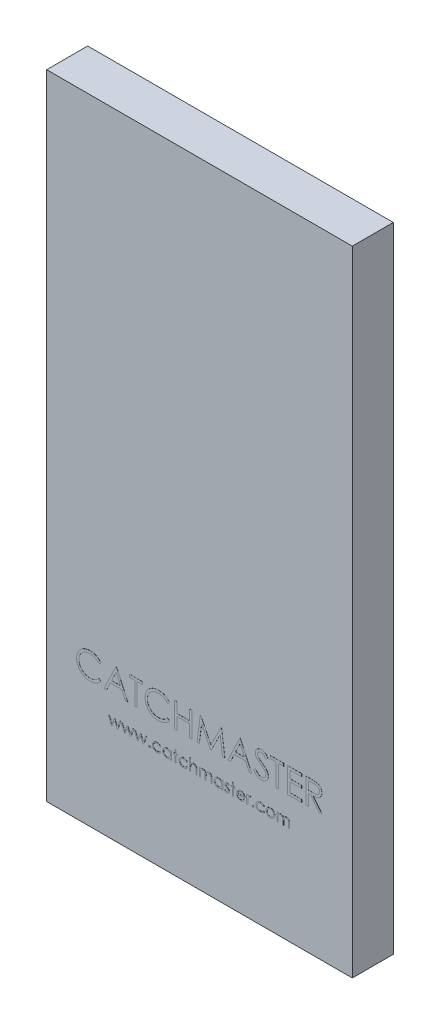
from build123d import *

# Parameters (mm, degrees)
SKETCH1_W           = 84.201
SKETCH1_H           = 174.625
BOSS_EXTRUDE1_DEPTH = 5.6515
BOSS_EXTRUDE2_DEPTH = 0.0254


with BuildPart() as part:
    # Sketch1 → Boss-Extrude1 (new, symmetric)
    with BuildSketch(Plane.XY):
        Rectangle(SKETCH1_W, SKETCH1_H)
    extrude(amount=BOSS_EXTRUDE1_DEPTH, both=True)

    # Sketch2 → Boss-Extrude2 (add)
    # profile 1 of 30: a face of its own
    with BuildSketch(Plane.XY.offset(5.6515)):
        Polygon((-25.135416667, -58.004807692), (-24.829492187, -58.004807692), (-24.138141026, -59.673717949), (-23.38064403, -58.004807692), (-23.332306691, -58.004807692), (-22.591346154, -59.673717949), (-21.893634816, -58.004807692), (-21.594070513, -58.004807692), (-22.563997396, -60.325), (-22.623147035, -60.325), (-23.36474359, -58.656089744), (-24.121604567, -60.325), (-24.17439403, -60.325), align=None)
    # profile 2 of 30: a face of its own
    with BuildSketch(Plane.XY.offset(5.6515)):
        Polygon((-21.553365385, -58.004807692), (-21.247440905, -58.004807692), (-20.556089744, -59.673717949), (-19.798592748, -58.004807692), (-19.750255409, -58.004807692), (-19.009294872, -59.673717949), (-18.311583534, -58.004807692), (-18.012019231, -58.004807692), (-18.981946114, -60.325), (-19.041095753, -60.325), (-19.782692308, -58.656089744), (-20.539553285, -60.325), (-20.592342748, -60.325), align=None)
    # profile 3 of 30: a face of its own
    with BuildSketch(Plane.XY.offset(5.6515)):
        Polygon((-17.971314103, -58.004807692), (-17.665389623, -58.004807692), (-16.974038462, -59.673717949), (-16.216541466, -58.004807692), (-16.168204127, -58.004807692), (-15.42724359, -59.673717949), (-14.729532252, -58.004807692), (-14.429967949, -58.004807692), (-15.399894832, -60.325), (-15.459044471, -60.325), (-16.200641026, -58.656089744), (-16.957502003, -60.325), (-17.010291466, -60.325), align=None)
    # profile 4 of 30: a face of its own
    with BuildSketch(Plane.XY.offset(5.6515)):
        with BuildLine():
            add(Edge.make_bspline(
                [(-13.758333333, -59.836538462), (-13.740652927, -59.837589084), (-13.705992556, -59.839648707), (-13.655882775, -59.853778975), (-13.610530477, -59.878869332), (-13.570133369, -59.912309138), (-13.536835351, -59.952854489), (-13.510850832, -59.997845064), (-13.496843652, -60.048374365), (-13.494799032, -60.083235571), (-13.49375, -60.101121795)],
                knots=[0, 0, 0, 0, 1.020151414, 1.999887582, 2.974338812, 3.990962822, 5.007586832, 5.987933904, 6.967670073, 8, 8, 8, 8], degree=3))
            add(Edge.make_bspline(
                [(-13.49375, -60.101121795), (-13.494834581, -60.118578244), (-13.496973358, -60.153002105), (-13.510818724, -60.203150289), (-13.537033384, -60.248168981), (-13.569903699, -60.289264492), (-13.610540463, -60.322775139), (-13.655989995, -60.34765203), (-13.705874923, -60.362794041), (-13.740633302, -60.364722896), (-13.758333333, -60.365705128)],
                knots=[0, 0, 0, 0, 1.009421747, 1.99056486, 2.972319754, 3.999869655, 5.017953583, 5.993804169, 6.978383603, 8, 8, 8, 8], degree=3))
            add(Edge.make_bspline(
                [(-13.758333333, -60.365705128), (-13.776046119, -60.364758436), (-13.810626117, -60.362910246), (-13.86032484, -60.347341129), (-13.906051162, -60.323008419), (-13.946680015, -60.289202008), (-13.979825628, -60.248380449), (-14.004885797, -60.202840248), (-14.019935432, -60.153145659), (-14.021914702, -60.118606518), (-14.022916667, -60.101121795)],
                knots=[0, 0, 0, 0, 1.022052826, 1.995314843, 2.982371812, 4.00089066, 5.028879526, 6.005146991, 6.990147033, 8, 8, 8, 8], degree=3))
            add(Edge.make_bspline(
                [(-14.022916667, -60.101121795), (-14.021953191, -60.083206286), (-14.020072123, -60.048228454), (-14.004854202, -59.998154978), (-13.980020067, -59.952645037), (-13.946450888, -59.912370996), (-13.906060991, -59.8786368), (-13.860435147, -59.854085166), (-13.810506421, -59.839534221), (-13.776025977, -59.837554367), (-13.758333333, -59.836538462)],
                knots=[0, 0, 0, 0, 1.032775665, 2.016367738, 2.991239715, 4.008302682, 5.025365648, 6.011011707, 6.979408107, 8, 8, 8, 8], degree=3))
        make_face()
    # profile 5 of 30: a face of its own
    with BuildSketch(Plane.XY.offset(5.6515)):
        with BuildLine():
            Line((-10.603685897, -58.507897636), (-10.842192508, -58.656089744))
            add(Edge.make_bspline(
                [(-10.842192508, -58.656089744), (-10.868345314, -58.623588272), (-10.919822674, -58.559614643), (-11.009211838, -58.477055633), (-11.104472192, -58.406146959), (-11.207231564, -58.348358556), (-11.317345826, -58.303707669), (-11.434380727, -58.272111697), (-11.558319577, -58.252422848), (-11.643287294, -58.250185075), (-11.686823918, -58.249038462)],
                knots=[0, 0, 0, 0, 1.026593902, 2.0206758, 2.988051866, 3.946915611, 4.916868779, 5.907761954, 6.927957743, 8, 8, 8, 8], degree=3))
            add(Edge.make_bspline(
                [(-11.686823918, -58.249038462), (-11.721620972, -58.249997168), (-11.790152823, -58.251885315), (-11.890760548, -58.263687692), (-11.986593254, -58.285134371), (-12.078251612, -58.313392738), (-12.165083706, -58.351266216), (-12.247317039, -58.397357923), (-12.325681019, -58.450924745), (-12.397904777, -58.512982883), (-12.463971091, -58.580473103), (-12.52121082, -58.652821098), (-12.571046466, -58.727859856), (-12.610149727, -58.807463223), (-12.642149346, -58.889810071), (-12.663201156, -58.976454783), (-12.677229844, -59.066287333), (-12.678834878, -59.127536112), (-12.679647436, -59.15854367)],
                knots=[0, 0, 0, 0, 1.112346261, 2.190735716, 3.231507886, 4.247384806, 5.251966152, 6.253067467, 7.256802811, 8.280671706, 9.291813951, 10.270744147, 11.225547591, 12.165006084, 13.100104208, 14.043489273, 15.009504848, 16, 16, 16, 16], degree=3))
            add(Edge.make_bspline(
                [(-12.679647436, -59.15854367), (-12.6780334, -59.19915574), (-12.674827076, -59.279832667), (-12.649697895, -59.39892066), (-12.608564039, -59.514058579), (-12.552268703, -59.62442896), (-12.481078731, -59.726567944), (-12.397465049, -59.818174364), (-12.301381309, -59.897473189), (-12.193674123, -59.963216123), (-12.076872456, -60.016067506), (-11.952240004, -60.053720587), (-11.820795203, -60.076446667), (-11.730800511, -60.079309559), (-11.684915865, -60.080769231)],
                knots=[0, 0, 0, 0, 0.966302908, 1.919585723, 2.883856336, 3.870342332, 4.860282998, 5.839159637, 6.814385684, 7.815993281, 8.834850808, 9.858348828, 10.908058873, 12, 12, 12, 12], degree=3))
            add(Edge.make_bspline(
                [(-11.684915865, -60.080769231), (-11.642865091, -60.079590401), (-11.56022416, -60.077273688), (-11.439422409, -60.057743843), (-11.324414918, -60.025772832), (-11.215205776, -59.981188893), (-11.11199454, -59.92356036), (-11.015448074, -59.852477398), (-10.923645273, -59.769984911), (-10.869673016, -59.706196466), (-10.842192508, -59.673717949)],
                knots=[0, 0, 0, 0, 1.039848629, 2.043578496, 3.018386758, 3.987534228, 4.954977003, 5.934852016, 6.948509513, 8, 8, 8, 8], degree=3))
            Line((-10.842192508, -59.673717949), (-10.603685897, -59.830178285))
            add(Edge.make_bspline(
                [(-10.603685897, -59.830178285), (-10.61782617, -59.850943445), (-10.646059782, -59.892404841), (-10.693256271, -59.950864861), (-10.744164976, -60.005585245), (-10.798587285, -60.056492641), (-10.855812587, -60.104805273), (-10.917795762, -60.148213487), (-10.982538195, -60.189157219), (-11.050799931, -60.225998896), (-11.121875207, -60.259115345), (-11.195664012, -60.287591621), (-11.271845699, -60.31205736), (-11.35050984, -60.331504096), (-11.43181152, -60.347026071), (-11.515540474, -60.3573255), (-11.601667866, -60.365013791), (-11.659881174, -60.365472685), (-11.689367989, -60.365705128)],
                knots=[0, 0, 0, 0, 0.954134338, 1.905101784, 2.851144739, 3.791306361, 4.734911809, 5.6936923, 6.663572882, 7.643865596, 8.638447847, 9.640600242, 10.646758161, 11.676244097, 12.717260333, 13.78922464, 14.880174919, 16, 16, 16, 16], degree=3))
            add(Edge.make_bspline(
                [(-11.689367989, -60.365705128), (-11.734372148, -60.36489661), (-11.822580625, -60.363311909), (-11.951687472, -60.345887077), (-12.075071298, -60.319618383), (-12.192689952, -60.281914138), (-12.304561743, -60.233377664), (-12.410582357, -60.174089605), (-12.510400745, -60.103557625), (-12.603029812, -60.023037112), (-12.688102981, -59.935733102), (-12.76115174, -59.841526391), (-12.824511378, -59.743880583), (-12.875390792, -59.640639085), (-12.915891932, -59.533174068), (-12.943564173, -59.420624636), (-12.961461864, -59.303918663), (-12.963533215, -59.224332406), (-12.964583333, -59.183984375)],
                knots=[0, 0, 0, 0, 1.1129367, 2.181364009, 3.217532258, 4.231199276, 5.232079859, 6.230262199, 7.231623845, 8.250719726, 9.263571943, 10.242672461, 11.195837495, 12.138959767, 13.085126421, 14.0317438, 15.002148558, 16, 16, 16, 16], degree=3))
            add(Edge.make_bspline(
                [(-12.964583333, -59.183984375), (-12.964183269, -59.156608224), (-12.963387474, -59.10215254), (-12.954259868, -59.021330587), (-12.942468396, -58.941584978), (-12.922487906, -58.863926547), (-12.899409619, -58.787177462), (-12.869949672, -58.712262792), (-12.835391707, -58.63883441), (-12.796156012, -58.567081469), (-12.751988365, -58.498184387), (-12.703110389, -58.433093563), (-12.651363026, -58.371027061), (-12.594325411, -58.31412765), (-12.53441801, -58.260119819), (-12.469945938, -58.210446378), (-12.401278987, -58.164961336), (-12.329448401, -58.122823629), (-12.254495985, -58.085304713), (-12.176874791, -58.052980276), (-12.097052543, -58.025355439), (-12.014901555, -58.003485205), (-11.930967098, -57.985145114), (-11.844587741, -57.973608211), (-11.75609394, -57.965456377), (-11.696171691, -57.964557587), (-11.665835337, -57.964102564)],
                knots=[0, 0, 0, 0, 0.990994727, 1.971252077, 2.943264845, 3.907940874, 4.872158414, 5.844625996, 6.82015047, 7.809835459, 8.804511986, 9.781214284, 10.756496977, 11.728388426, 12.696359165, 13.676225489, 14.672885716, 15.677705647, 16.690706858, 17.706033469, 18.721040654, 19.747369689, 20.783475414, 21.830280724, 22.901553713, 24, 24, 24, 24], degree=3))
            add(Edge.make_bspline(
                [(-11.665835337, -57.964102564), (-11.627844096, -57.964938851), (-11.552051512, -57.966607245), (-11.439619585, -57.980648593), (-11.328843659, -58.001818057), (-11.221667358, -58.033180552), (-11.119390163, -58.071156869), (-11.023654433, -58.113804117), (-10.936713768, -58.163329221), (-10.856950883, -58.217503897), (-10.784216607, -58.278609861), (-10.717764317, -58.347377601), (-10.656231321, -58.423449221), (-10.62134559, -58.479515849), (-10.603685897, -58.507897636)],
                knots=[0, 0, 0, 0, 1.095225653, 2.184976855, 3.262915854, 4.344593502, 5.400796181, 6.407717688, 7.363229445, 8.282371371, 9.184954523, 10.097238608, 11.036792983, 12, 12, 12, 12], degree=3))
        make_face()
    # profile 6 of 30: a face of its own
    with BuildSketch(Plane.XY.offset(5.6515)):
        with BuildLine():
            Line((-7.672916667, -58.004807692), (-7.672916667, -60.325))
            Line((-7.672916667, -60.325), (-7.957852564, -60.325))
            Line((-7.957852564, -60.325), (-7.957852564, -59.923672877))
            add(Edge.make_bspline(
                [(-7.957852564, -59.923672877), (-7.989982467, -59.959994508), (-8.052684377, -60.030876629), (-8.157405962, -60.123479743), (-8.268411381, -60.200022934), (-8.385161865, -60.261844644), (-8.507551986, -60.308283152), (-8.635310436, -60.341290596), (-8.768489332, -60.362512147), (-8.859432539, -60.364631252), (-8.90551883, -60.365705128)],
                knots=[0, 0, 0, 0, 1.074387032, 2.096679803, 3.090159297, 4.057316773, 5.018401886, 5.985159533, 6.978961417, 8, 8, 8, 8], degree=3))
            add(Edge.make_bspline(
                [(-8.90551883, -60.365705128), (-8.946492617, -60.364592633), (-9.027294738, -60.362398744), (-9.14615683, -60.345378655), (-9.260540513, -60.318045876), (-9.370553876, -60.280035784), (-9.475485036, -60.229616038), (-9.576232409, -60.169253621), (-9.672274066, -60.097370868), (-9.762146105, -60.015194585), (-9.844906562, -59.925936275), (-9.917533574, -59.830735672), (-9.978088153, -59.730004439), (-10.028724941, -59.625017935), (-10.067728768, -59.514967972), (-10.094919136, -59.400235113), (-10.111919398, -59.280955013), (-10.11411238, -59.199729874), (-10.115224359, -59.15854367)],
                knots=[0, 0, 0, 0, 1.033919861, 2.038935746, 3.024066025, 3.998881131, 4.97069526, 5.957263378, 6.95902576, 7.993208707, 9.027059324, 10.027763471, 11.009749337, 11.988697705, 12.965288445, 13.950418724, 14.960734635, 16, 16, 16, 16], degree=3))
            add(Edge.make_bspline(
                [(-10.115224359, -59.15854367), (-10.114087735, -59.118208739), (-10.111840691, -59.038468756), (-10.095100984, -58.921194508), (-10.066951426, -58.808238658), (-10.027447307, -58.699964859), (-9.976790677, -58.596242099), (-9.915170198, -58.49699702), (-9.84258142, -58.401956209), (-9.758895308, -58.313354453), (-9.668240195, -58.231511467), (-9.571258704, -58.160383262), (-9.470363298, -58.098954406), (-9.363988996, -58.050283038), (-9.253710265, -58.010904779), (-9.138545354, -57.983660587), (-9.018973422, -57.967606588), (-8.937792761, -57.965281795), (-8.896614583, -57.964102564)],
                knots=[0, 0, 0, 0, 1.020392517, 2.01726096, 2.990465484, 3.961182959, 4.928053699, 5.906110375, 6.912531644, 7.948652711, 8.985773172, 9.998621852, 10.987621588, 11.969261332, 12.953316658, 13.946091881, 14.958173133, 16, 16, 16, 16], degree=3))
            add(Edge.make_bspline(
                [(-8.896614583, -57.964102564), (-8.849261854, -57.96540681), (-8.756405387, -57.967964375), (-8.620580693, -57.989248421), (-8.492088916, -58.025206173), (-8.369938183, -58.074117046), (-8.254567132, -58.139112679), (-8.147067996, -58.221100215), (-8.046315736, -58.319562577), (-7.987913614, -58.395191481), (-7.957852564, -58.434119591)],
                knots=[0, 0, 0, 0, 1.038897134, 2.037228247, 3.008116434, 3.962042015, 4.918381754, 5.904844433, 6.921570401, 8, 8, 8, 8], degree=3))
            Line((-7.957852564, -58.434119591), (-7.957852564, -58.004807692))
            Line((-7.957852564, -58.004807692), (-7.672916667, -58.004807692))
        make_face()
        with BuildLine():
            add(Edge.make_bspline(
                [(-8.892798478, -58.249038462), (-8.934449341, -58.250520404), (-9.016661521, -58.253445524), (-9.137351437, -58.27628148), (-9.252842892, -58.314276791), (-9.362558259, -58.366239658), (-9.464764427, -58.431580012), (-9.556107971, -58.510611553), (-9.637335993, -58.601177987), (-9.705651347, -58.702870616), (-9.761341298, -58.811889313), (-9.800499962, -58.925848624), (-9.826325637, -59.04269314), (-9.828964081, -59.121943576), (-9.830288462, -59.161723758)],
                knots=[0, 0, 0, 0, 1.031046209, 2.035121221, 3.029706178, 4.034933723, 5.034054252, 6.02443088, 7.017295772, 8.038157696, 9.050218397, 10.03989886, 11.016116709, 12, 12, 12, 12], degree=3))
            add(Edge.make_bspline(
                [(-9.830288462, -59.161723758), (-9.828596737, -59.201266212), (-9.825219919, -59.280196128), (-9.800953217, -59.397199937), (-9.760240761, -59.511186104), (-9.704685461, -59.621187148), (-9.635119737, -59.72331701), (-9.554485031, -59.815609836), (-9.462001561, -59.894975391), (-9.35956018, -59.961412333), (-9.250151521, -60.015081191), (-9.135095026, -60.052424307), (-9.016553554, -60.076534151), (-8.935951794, -60.079350355), (-8.895342548, -60.080769231)],
                knots=[0, 0, 0, 0, 0.979072187, 1.954306742, 2.945804271, 3.96968567, 4.997920485, 5.998718438, 6.996577872, 8.005894225, 9.015743152, 10.005417472, 10.995077863, 12, 12, 12, 12], degree=3))
            add(Edge.make_bspline(
                [(-8.895342548, -60.080769231), (-8.854116078, -60.079263406), (-8.772120717, -60.076268471), (-8.651072746, -60.053334752), (-8.533602316, -60.015444485), (-8.421309616, -59.962921705), (-8.316701411, -59.897827533), (-8.222814051, -59.8216211), (-8.143424565, -59.732990354), (-8.076121269, -59.635584572), (-8.023347856, -59.528802975), (-7.984906716, -59.415106959), (-7.962179244, -59.294492566), (-7.959314733, -59.212066004), (-7.957852564, -59.169991987)],
                knots=[0, 0, 0, 0, 1.01762866, 2.023962475, 3.030623092, 4.058876274, 5.077231937, 6.066672613, 7.034107872, 8.005628644, 8.981990164, 9.965428785, 10.961468474, 12, 12, 12, 12], degree=3))
            add(Edge.make_bspline(
                [(-7.957852564, -59.169991987), (-7.95872311, -59.137935527), (-7.960436618, -59.074838268), (-7.973527206, -58.98219402), (-7.994350604, -58.893535568), (-8.023693201, -58.8087697), (-8.062238866, -58.728365079), (-8.108727911, -58.651744382), (-8.163977855, -58.579306112), (-8.2270993, -58.512047755), (-8.29619202, -58.450700893), (-8.369302782, -58.395941903), (-8.447297788, -58.350957802), (-8.528865386, -58.313727506), (-8.614147096, -58.284100991), (-8.703836873, -58.26433644), (-8.796981382, -58.250765292), (-8.860523161, -58.249620132), (-8.892798478, -58.249038462)],
                knots=[0, 0, 0, 0, 1.050140795, 2.067009409, 3.05949893, 4.030605086, 5.00011959, 5.97591094, 6.962425594, 7.979863591, 8.993523472, 9.986985069, 10.967611495, 11.937549037, 12.921786183, 13.919465291, 14.943216303, 16, 16, 16, 16], degree=3))
        make_face(mode=Mode.SUBTRACT)
    # profile 7 of 30: a face of its own
    with BuildSketch(Plane.XY.offset(5.6515)):
        Polygon((-6.736698718, -57.068589744), (-6.451762821, -57.068589744), (-6.451762821, -58.004807692), (-6.044711538, -58.004807692), (-6.044711538, -58.28974359), (-6.451762821, -58.28974359), (-6.451762821, -60.325), (-6.736698718, -60.325), (-6.736698718, -58.28974359), (-7.14375, -58.28974359), (-7.14375, -58.004807692), (-6.736698718, -58.004807692), align=None)
    # profile 8 of 30: a face of its own
    with BuildSketch(Plane.XY.offset(5.6515)):
        with BuildLine():
            Line((-3.276762821, -58.507897636), (-3.515269431, -58.656089744))
            add(Edge.make_bspline(
                [(-3.515269431, -58.656089744), (-3.541422238, -58.623588272), (-3.592899597, -58.559614643), (-3.682288761, -58.477055633), (-3.777549116, -58.406146959), (-3.880308487, -58.348358556), (-3.990422749, -58.303707669), (-4.10745765, -58.272111697), (-4.231396501, -58.252422848), (-4.316364217, -58.250185075), (-4.359900841, -58.249038462)],
                knots=[0, 0, 0, 0, 1.026593902, 2.0206758, 2.988051866, 3.946915611, 4.916868779, 5.907761954, 6.927957743, 8, 8, 8, 8], degree=3))
            add(Edge.make_bspline(
                [(-4.359900841, -58.249038462), (-4.394697895, -58.249997168), (-4.463229746, -58.251885315), (-4.563837471, -58.263687692), (-4.659670177, -58.285134371), (-4.751328535, -58.313392738), (-4.838160629, -58.351266216), (-4.920393962, -58.397357923), (-4.998757942, -58.450924745), (-5.0709817, -58.512982883), (-5.137048014, -58.580473103), (-5.194287743, -58.652821098), (-5.24412339, -58.727859856), (-5.28322665, -58.807463223), (-5.315226269, -58.889810071), (-5.336278079, -58.976454783), (-5.350306767, -59.066287333), (-5.351911801, -59.127536112), (-5.352724359, -59.15854367)],
                knots=[0, 0, 0, 0, 1.112346261, 2.190735716, 3.231507886, 4.247384806, 5.251966152, 6.253067467, 7.256802811, 8.280671706, 9.291813951, 10.270744147, 11.225547591, 12.165006084, 13.100104208, 14.043489273, 15.009504848, 16, 16, 16, 16], degree=3))
            add(Edge.make_bspline(
                [(-5.352724359, -59.15854367), (-5.351110323, -59.19915574), (-5.347903999, -59.279832667), (-5.322774818, -59.39892066), (-5.281640962, -59.514058579), (-5.225345626, -59.62442896), (-5.154155655, -59.726567944), (-5.070541972, -59.818174364), (-4.974458232, -59.897473189), (-4.866751047, -59.963216123), (-4.749949379, -60.016067506), (-4.625316927, -60.053720587), (-4.493872126, -60.076446667), (-4.403877434, -60.079309559), (-4.357992788, -60.080769231)],
                knots=[0, 0, 0, 0, 0.966302908, 1.919585723, 2.883856336, 3.870342332, 4.860282998, 5.839159637, 6.814385684, 7.815993281, 8.834850808, 9.858348828, 10.908058873, 12, 12, 12, 12], degree=3))
            add(Edge.make_bspline(
                [(-4.357992788, -60.080769231), (-4.315942014, -60.079590401), (-4.233301083, -60.077273688), (-4.112499332, -60.057743843), (-3.997491841, -60.025772832), (-3.888282699, -59.981188893), (-3.785071463, -59.92356036), (-3.688524997, -59.852477398), (-3.596722196, -59.769984911), (-3.542749939, -59.706196466), (-3.515269431, -59.673717949)],
                knots=[0, 0, 0, 0, 1.039848629, 2.043578496, 3.018386758, 3.987534228, 4.954977003, 5.934852016, 6.948509513, 8, 8, 8, 8], degree=3))
            Line((-3.515269431, -59.673717949), (-3.276762821, -59.830178285))
            add(Edge.make_bspline(
                [(-3.276762821, -59.830178285), (-3.290903093, -59.850943445), (-3.319136705, -59.892404841), (-3.366333194, -59.950864861), (-3.417241899, -60.005585245), (-3.471664208, -60.056492641), (-3.52888951, -60.104805273), (-3.590872685, -60.148213487), (-3.655615118, -60.189157219), (-3.723876854, -60.225998896), (-3.79495213, -60.259115345), (-3.868740935, -60.287591621), (-3.944922622, -60.31205736), (-4.023586763, -60.331504096), (-4.104888443, -60.347026071), (-4.188617397, -60.3573255), (-4.274744789, -60.365013791), (-4.332958097, -60.365472685), (-4.362444912, -60.365705128)],
                knots=[0, 0, 0, 0, 0.954134338, 1.905101784, 2.851144739, 3.791306361, 4.734911809, 5.6936923, 6.663572882, 7.643865596, 8.638447847, 9.640600242, 10.646758161, 11.676244097, 12.717260333, 13.78922464, 14.880174919, 16, 16, 16, 16], degree=3))
            add(Edge.make_bspline(
                [(-4.362444912, -60.365705128), (-4.407449071, -60.36489661), (-4.495657548, -60.363311909), (-4.624764395, -60.345887077), (-4.748148221, -60.319618383), (-4.865766875, -60.281914138), (-4.977638666, -60.233377664), (-5.08365928, -60.174089605), (-5.183477668, -60.103557625), (-5.276106735, -60.023037112), (-5.361179904, -59.935733102), (-5.434228663, -59.841526391), (-5.497588301, -59.743880583), (-5.548467715, -59.640639085), (-5.588968855, -59.533174068), (-5.616641096, -59.420624636), (-5.634538787, -59.303918663), (-5.636610139, -59.224332406), (-5.637660256, -59.183984375)],
                knots=[0, 0, 0, 0, 1.1129367, 2.181364009, 3.217532258, 4.231199276, 5.232079859, 6.230262199, 7.231623845, 8.250719726, 9.263571943, 10.242672461, 11.195837495, 12.138959767, 13.085126421, 14.0317438, 15.002148558, 16, 16, 16, 16], degree=3))
            add(Edge.make_bspline(
                [(-5.637660256, -59.183984375), (-5.637260192, -59.156608224), (-5.636464397, -59.10215254), (-5.627336791, -59.021330587), (-5.615545319, -58.941584978), (-5.595564829, -58.863926547), (-5.572486542, -58.787177462), (-5.543026595, -58.712262792), (-5.50846863, -58.63883441), (-5.469232935, -58.567081469), (-5.425065288, -58.498184387), (-5.376187312, -58.433093563), (-5.32443995, -58.371027061), (-5.267402334, -58.31412765), (-5.207494933, -58.260119819), (-5.143022861, -58.210446378), (-5.07435591, -58.164961336), (-5.002525325, -58.122823629), (-4.927572908, -58.085304713), (-4.849951714, -58.052980276), (-4.770129466, -58.025355439), (-4.687978478, -58.003485205), (-4.604044021, -57.985145114), (-4.517664664, -57.973608211), (-4.429170863, -57.965456377), (-4.369248614, -57.964557587), (-4.33891226, -57.964102564)],
                knots=[0, 0, 0, 0, 0.990994727, 1.971252077, 2.943264845, 3.907940874, 4.872158414, 5.844625996, 6.82015047, 7.809835459, 8.804511986, 9.781214284, 10.756496977, 11.728388426, 12.696359165, 13.676225489, 14.672885716, 15.677705647, 16.690706858, 17.706033469, 18.721040654, 19.747369689, 20.783475414, 21.830280724, 22.901553713, 24, 24, 24, 24], degree=3))
            add(Edge.make_bspline(
                [(-4.33891226, -57.964102564), (-4.300921019, -57.964938851), (-4.225128435, -57.966607245), (-4.112696508, -57.980648593), (-4.001920582, -58.001818057), (-3.894744281, -58.033180552), (-3.792467086, -58.071156869), (-3.696731356, -58.113804117), (-3.609790691, -58.163329221), (-3.530027806, -58.217503897), (-3.45729353, -58.278609861), (-3.39084124, -58.347377601), (-3.329308244, -58.423449221), (-3.294422513, -58.479515849), (-3.276762821, -58.507897636)],
                knots=[0, 0, 0, 0, 1.095225653, 2.184976855, 3.262915854, 4.344593502, 5.400796181, 6.407717688, 7.363229445, 8.282371371, 9.184954523, 10.097238608, 11.036792983, 12, 12, 12, 12], degree=3))
        make_face()
    # profile 9 of 30: a face of its own
    with BuildSketch(Plane.XY.offset(5.6515)):
        with BuildLine():
            Line((-2.706891026, -57.068589744), (-2.421955128, -57.068589744))
            Line((-2.421955128, -57.068589744), (-2.421955128, -58.443023838))
            add(Edge.make_bspline(
                [(-2.421955128, -58.443023838), (-2.391368719, -58.404793226), (-2.331815413, -58.330356265), (-2.23157965, -58.23323647), (-2.128645358, -58.149054864), (-2.019457281, -58.082043806), (-1.906018595, -58.029106085), (-1.78785086, -57.991561577), (-1.664932122, -57.968473796), (-1.581452164, -57.965572374), (-1.53916266, -57.964102564)],
                knots=[0, 0, 0, 0, 1.125788106, 2.19196713, 3.20547328, 4.180437432, 5.132270164, 6.079753143, 7.027236121, 8, 8, 8, 8], degree=3))
            add(Edge.make_bspline(
                [(-1.53916266, -57.964102564), (-1.496227232, -57.965685919), (-1.412192244, -57.968784926), (-1.289835488, -57.993289921), (-1.17557098, -58.035161311), (-1.069738394, -58.092462827), (-0.974647419, -58.16383032), (-0.890419419, -58.246227487), (-0.82162098, -58.34172597), (-0.774813209, -58.429951286), (-0.744357332, -58.508454299), (-0.72507889, -58.575797421), (-0.708732903, -58.650838013), (-0.694491, -58.733537449), (-0.684999036, -58.824292712), (-0.677374847, -58.922694357), (-0.671953349, -59.028736743), (-0.671743251, -59.102142969), (-0.671634615, -59.140099159)],
                knots=[0, 0, 0, 0, 1.235656852, 2.418478516, 3.575258207, 4.727955599, 5.870717718, 6.98870536, 8.107142894, 9.245821548, 9.854588956, 10.528768408, 11.260415777, 12.065282286, 12.943670737, 13.886611085, 14.907229059, 16, 16, 16, 16], degree=3))
            Line((-0.671634615, -59.140099159), (-0.671634615, -60.325))
            Line((-0.671634615, -60.325), (-0.956570513, -60.325))
            Line((-0.956570513, -60.325), (-0.956570513, -59.23359375))
            add(Edge.make_bspline(
                [(-0.956570513, -59.23359375), (-0.956743145, -59.202004614), (-0.957073361, -59.141579973), (-0.958164966, -59.055069289), (-0.960601747, -58.976604938), (-0.964539497, -58.906438389), (-0.968680883, -58.844471821), (-0.974380749, -58.790795221), (-0.981012175, -58.745334868), (-0.986970999, -58.717971241), (-0.989643429, -58.705699119)],
                knots=[0, 0, 0, 0, 1.430932559, 2.737130458, 3.918967929, 4.986496826, 5.920444988, 6.731744033, 7.431208747, 8, 8, 8, 8], degree=3))
            add(Edge.make_bspline(
                [(-0.989643429, -58.705699119), (-1.000006852, -58.669690751), (-1.019930471, -58.600464874), (-1.066238279, -58.506428259), (-1.12407681, -58.426250672), (-1.194695398, -58.36101414), (-1.276844771, -58.309840815), (-1.371060595, -58.274400755), (-1.476456143, -58.252404607), (-1.550707121, -58.250191811), (-1.589408053, -58.249038462)],
                knots=[0, 0, 0, 0, 1.090059168, 2.095632401, 3.037101401, 3.955032261, 4.878929692, 5.839099886, 6.873700383, 8, 8, 8, 8], degree=3))
            add(Edge.make_bspline(
                [(-1.589408053, -58.249038462), (-1.612329533, -58.249470104), (-1.657690549, -58.250324313), (-1.724953982, -58.25890035), (-1.790203918, -58.272914544), (-1.854068751, -58.291877947), (-1.915194937, -58.317682113), (-1.975364204, -58.347554499), (-2.032871808, -58.384119844), (-2.088738941, -58.425146076), (-2.140734132, -58.470566501), (-2.189109444, -58.518506239), (-2.23223351, -58.569555671), (-2.271302875, -58.622895776), (-2.305028891, -58.679258189), (-2.334468473, -58.738099392), (-2.359447283, -58.799496767), (-2.371859439, -58.842109858), (-2.378069912, -58.86343149)],
                knots=[0, 0, 0, 0, 1.024319606, 2.027102035, 3.025350316, 4.005802111, 5.00026367, 5.987881639, 7.005602596, 8.042517216, 9.083927026, 10.089214625, 11.084353441, 12.06828073, 13.041928858, 14.016821737, 15.00770877, 16, 16, 16, 16], degree=3))
            add(Edge.make_bspline(
                [(-2.378069912, -58.86343149), (-2.381643535, -58.878871924), (-2.3894309, -58.912518531), (-2.397880785, -58.968012382), (-2.405444357, -59.032497876), (-2.411838399, -59.105877207), (-2.415760056, -59.188419262), (-2.419985746, -59.279560775), (-2.421558744, -59.379872651), (-2.421819051, -59.449627861), (-2.421955128, -59.486092748)],
                knots=[0, 0, 0, 0, 0.607992626, 1.324890765, 2.152360218, 3.099583803, 4.150613268, 5.323148443, 6.60066238, 8, 8, 8, 8], degree=3))
            Line((-2.421955128, -59.486092748), (-2.421955128, -60.325))
            Line((-2.421955128, -60.325), (-2.706891026, -60.325))
            Line((-2.706891026, -60.325), (-2.706891026, -57.068589744))
        make_face()
    # profile 10 of 30: a face of its own
    with BuildSketch(Plane.XY.offset(5.6515)):
        with BuildLine():
            Line((-0.020352564, -58.004807692), (0.264583333, -58.004807692))
            Line((0.264583333, -58.004807692), (0.264583333, -58.408042869))
            add(Edge.make_bspline(
                [(0.264583333, -58.408042869), (0.290240916, -58.372766258), (0.339403306, -58.305172891), (0.420017147, -58.216100276), (0.500549764, -58.140509736), (0.558546474, -58.100828703), (0.586408253, -58.081765825)],
                knots=[0, 0, 0, 0, 1.134379233, 2.173579362, 3.122582517, 4, 4, 4, 4], degree=3))
            add(Edge.make_bspline(
                [(0.586408253, -58.081765825), (0.624385482, -58.063618101), (0.699676434, -58.027639715), (0.818892446, -57.991142129), (0.940880181, -57.96871293), (1.023256204, -57.965645541), (1.06469351, -57.964102564)],
                knots=[0, 0, 0, 0, 1.014936303, 2.012140481, 3.000054389, 4, 4, 4, 4], degree=3))
            add(Edge.make_bspline(
                [(1.06469351, -57.964102564), (1.092717871, -57.965050792), (1.148176575, -57.966927285), (1.230349285, -57.979137459), (1.310049597, -58.000243202), (1.386806609, -58.029641274), (1.459124654, -58.065243626), (1.525426998, -58.10701729), (1.58495753, -58.153913922), (1.637686162, -58.20805124), (1.685101635, -58.27094944), (1.728716017, -58.344304866), (1.769016031, -58.429764673), (1.791351076, -58.491782892), (1.803109976, -58.524434095)],
                knots=[0, 0, 0, 0, 1.009824226, 1.998387844, 2.986035974, 3.974953746, 4.955485308, 5.885931332, 6.793869504, 7.679848016, 8.601185859, 9.625726857, 10.749998409, 12, 12, 12, 12], degree=3))
            add(Edge.make_bspline(
                [(1.803109976, -58.524434095), (1.81554804, -58.502005514), (1.840024402, -58.457869218), (1.881123087, -58.395404937), (1.92418316, -58.336978776), (1.969571593, -58.282544377), (2.017128182, -58.23237055), (2.067076738, -58.18629141), (2.119132933, -58.144109074), (2.191515893, -58.094830208), (2.285688759, -58.042486993), (2.404422977, -57.997104047), (2.527930633, -57.969058702), (2.611766688, -57.965765526), (2.654101563, -57.964102564)],
                knots=[0, 0, 0, 0, 0.86119277, 1.694706429, 2.50939023, 3.298075842, 4.073795165, 4.829715201, 5.57930267, 6.321991688, 7.768977793, 9.186738141, 10.579381044, 12, 12, 12, 12], degree=3))
            add(Edge.make_bspline(
                [(2.654101563, -57.964102564), (2.693001175, -57.965569614), (2.769131494, -57.968440774), (2.879963728, -57.990986425), (2.983325223, -58.029701148), (3.079007999, -58.082527375), (3.165331544, -58.148911349), (3.240367053, -58.227895223), (3.30365874, -58.318920317), (3.345005077, -58.404547335), (3.373049638, -58.480144387), (3.390340901, -58.544557237), (3.40561691, -58.61545186), (3.418299897, -58.692913026), (3.427569583, -58.777214363), (3.434437304, -58.868217915), (3.439085571, -58.965994409), (3.439414022, -59.033454541), (3.439583333, -59.068229167)],
                knots=[0, 0, 0, 0, 1.209669288, 2.367440248, 3.500751976, 4.631527125, 5.755587489, 6.87532382, 8.007944318, 9.190864318, 9.82315674, 10.514484317, 11.263564316, 12.079023757, 12.955305781, 13.901327259, 14.918167583, 16, 16, 16, 16], degree=3))
            Line((3.439583333, -59.068229167), (3.439583333, -60.325))
            Line((3.439583333, -60.325), (3.154647436, -60.325))
            Line((3.154647436, -60.325), (3.154647436, -59.066957131))
            add(Edge.make_bspline(
                [(3.154647436, -59.066957131), (3.154576785, -59.037274896), (3.154441004, -58.980230155), (3.151997496, -58.898358289), (3.147393461, -58.823729136), (3.142009896, -58.756444456), (3.134531583, -58.696347341), (3.124874202, -58.643558504), (3.114643735, -58.597662689), (3.097647515, -58.546784632), (3.070480499, -58.490659512), (3.029098928, -58.430131697), (2.976965331, -58.377444114), (2.916767189, -58.331707498), (2.848233957, -58.294520409), (2.772700958, -58.267962886), (2.69063714, -58.251522847), (2.633829325, -58.249884533), (2.604492188, -58.249038462)],
                knots=[0, 0, 0, 0, 1.253487763, 2.409012846, 3.458416907, 4.410876679, 5.259312806, 6.014470957, 6.676830364, 7.243083969, 8.276244668, 9.299465089, 10.325150304, 11.392391894, 12.482080715, 13.603491619, 14.762376348, 16, 16, 16, 16], degree=3))
            add(Edge.make_bspline(
                [(2.604492188, -58.249038462), (2.568505872, -58.250323119), (2.497383231, -58.252862089), (2.393564826, -58.278782674), (2.293805403, -58.317862616), (2.201081676, -58.374497773), (2.115785037, -58.442359646), (2.042397563, -58.523049637), (1.981771223, -58.614335356), (1.940719402, -58.698832722), (1.914784822, -58.77473286), (1.897660762, -58.841042619), (1.884340829, -58.91640947), (1.871848991, -59.000326979), (1.863695838, -59.093372786), (1.856285958, -59.195116478), (1.852819889, -59.30586407), (1.852335059, -59.382632566), (1.852083333, -59.422490986)],
                knots=[0, 0, 0, 0, 1.090531906, 2.155305635, 3.229839962, 4.33261226, 5.44038871, 6.529323825, 7.629011124, 8.757537029, 9.370236727, 10.061839251, 10.834451254, 11.692844982, 12.636905849, 13.66920014, 14.789842145, 16, 16, 16, 16], degree=3))
            Line((1.852083333, -59.422490986), (1.852083333, -60.325))
            Line((1.852083333, -60.325), (1.567147436, -60.325))
            Line((1.567147436, -60.325), (1.567147436, -59.1451873))
            add(Edge.make_bspline(
                [(1.567147436, -59.1451873), (1.567075381, -59.111901218), (1.566936754, -59.047862141), (1.564508951, -58.956028736), (1.559894659, -58.872498042), (1.554560161, -58.797367143), (1.546885571, -58.73077258), (1.538168144, -58.672357335), (1.527873333, -58.622267854), (1.510828223, -58.567328212), (1.484780099, -58.506802803), (1.442880747, -58.442267734), (1.390622442, -58.385781674), (1.329326004, -58.337559095), (1.260377992, -58.297697894), (1.18419305, -58.268977977), (1.101457165, -58.252264514), (1.044418103, -58.250134092), (1.015084135, -58.249038462)],
                knots=[0, 0, 0, 0, 1.320475261, 2.540461679, 3.643808994, 4.639130445, 5.527981419, 6.302341397, 6.981980563, 7.553956391, 8.582137848, 9.585246428, 10.591171744, 11.620968678, 12.668337649, 13.738356861, 14.836885341, 16, 16, 16, 16], degree=3))
            add(Edge.make_bspline(
                [(1.015084135, -58.249038462), (0.980598, -58.250426807), (0.911868358, -58.253193731), (0.810901571, -58.27809868), (0.713396701, -58.317109519), (0.620909225, -58.371229498), (0.53593339, -58.438266519), (0.461540176, -58.517110746), (0.398999457, -58.606780941), (0.357514167, -58.690387324), (0.330754837, -58.764385937), (0.312979069, -58.827297154), (0.297703123, -58.897147379), (0.286351118, -58.974152116), (0.275392455, -59.057809823), (0.270103532, -59.148537253), (0.264958615, -59.246256575), (0.264711496, -59.313723098), (0.264583333, -59.348712941)],
                knots=[0, 0, 0, 0, 1.098833095, 2.189935336, 3.297829714, 4.440610912, 5.596351641, 6.740013378, 7.886572111, 9.072425424, 9.705826452, 10.395263256, 11.156850408, 11.985370555, 12.878090359, 13.847760091, 14.883794034, 16, 16, 16, 16], degree=3))
            Line((0.264583333, -59.348712941), (0.264583333, -60.325))
            Line((0.264583333, -60.325), (-0.020352564, -60.325))
            Line((-0.020352564, -60.325), (-0.020352564, -58.004807692))
        make_face()
    # profile 11 of 30: a face of its own
    with BuildSketch(Plane.XY.offset(5.6515)):
        with BuildLine():
            Line((6.451762821, -58.004807692), (6.451762821, -60.325))
            Line((6.451762821, -60.325), (6.166826923, -60.325))
            Line((6.166826923, -60.325), (6.166826923, -59.923672877))
            add(Edge.make_bspline(
                [(6.166826923, -59.923672877), (6.13469702, -59.959994508), (6.071995111, -60.030876629), (5.967273525, -60.123479743), (5.856268106, -60.200022934), (5.739517622, -60.261844644), (5.617127502, -60.308283152), (5.489369051, -60.341290596), (5.356190155, -60.362512147), (5.265246948, -60.364631252), (5.219160657, -60.365705128)],
                knots=[0, 0, 0, 0, 1.074387032, 2.096679803, 3.090159297, 4.057316773, 5.018401886, 5.985159533, 6.978961417, 8, 8, 8, 8], degree=3))
            add(Edge.make_bspline(
                [(5.219160657, -60.365705128), (5.17818687, -60.364592633), (5.097384749, -60.362398744), (4.978522657, -60.345378655), (4.864138974, -60.318045876), (4.754125612, -60.280035784), (4.649194451, -60.229616038), (4.548447078, -60.169253621), (4.452405421, -60.097370868), (4.362533382, -60.015194585), (4.279772925, -59.925936275), (4.207145913, -59.830735672), (4.146591334, -59.730004439), (4.095954546, -59.625017935), (4.05695072, -59.514967972), (4.029760351, -59.400235113), (4.012760089, -59.280955013), (4.010567107, -59.199729874), (4.009455128, -59.15854367)],
                knots=[0, 0, 0, 0, 1.033919861, 2.038935746, 3.024066025, 3.998881131, 4.97069526, 5.957263378, 6.95902576, 7.993208707, 9.027059324, 10.027763471, 11.009749337, 11.988697705, 12.965288445, 13.950418724, 14.960734635, 16, 16, 16, 16], degree=3))
            add(Edge.make_bspline(
                [(4.009455128, -59.15854367), (4.010591752, -59.118208739), (4.012838797, -59.038468756), (4.029578503, -58.921194508), (4.057728061, -58.808238658), (4.09723218, -58.699964859), (4.147888811, -58.596242099), (4.20950929, -58.49699702), (4.282098067, -58.401956209), (4.365784179, -58.313354453), (4.456439292, -58.231511467), (4.553420784, -58.160383262), (4.654316189, -58.098954406), (4.760690491, -58.050283038), (4.870969222, -58.010904779), (4.986134133, -57.983660587), (5.105706066, -57.967606588), (5.186886726, -57.965281795), (5.228064904, -57.964102564)],
                knots=[0, 0, 0, 0, 1.020392517, 2.01726096, 2.990465484, 3.961182959, 4.928053699, 5.906110375, 6.912531644, 7.948652711, 8.985773172, 9.998621852, 10.987621588, 11.969261332, 12.953316658, 13.946091881, 14.958173133, 16, 16, 16, 16], degree=3))
            add(Edge.make_bspline(
                [(5.228064904, -57.964102564), (5.275417633, -57.96540681), (5.3682741, -57.967964375), (5.504098795, -57.989248421), (5.632590571, -58.025206173), (5.754741305, -58.074117046), (5.870112355, -58.139112679), (5.977611491, -58.221100215), (6.078363751, -58.319562577), (6.136765873, -58.395191481), (6.166826923, -58.434119591)],
                knots=[0, 0, 0, 0, 1.038897134, 2.037228247, 3.008116434, 3.962042015, 4.918381754, 5.904844433, 6.921570401, 8, 8, 8, 8], degree=3))
            Line((6.166826923, -58.434119591), (6.166826923, -58.004807692))
            Line((6.166826923, -58.004807692), (6.451762821, -58.004807692))
        make_face()
        with BuildLine():
            add(Edge.make_bspline(
                [(5.23188101, -58.249038462), (5.190230146, -58.250520404), (5.108017966, -58.253445524), (4.98732805, -58.27628148), (4.871836596, -58.314276791), (4.762121228, -58.366239658), (4.65991506, -58.431580012), (4.568571516, -58.510611553), (4.487343494, -58.601177987), (4.41902814, -58.702870616), (4.363338189, -58.811889313), (4.324179525, -58.925848624), (4.29835385, -59.04269314), (4.295715407, -59.121943576), (4.294391026, -59.161723758)],
                knots=[0, 0, 0, 0, 1.031046209, 2.035121221, 3.029706178, 4.034933723, 5.034054252, 6.02443088, 7.017295772, 8.038157696, 9.050218397, 10.03989886, 11.016116709, 12, 12, 12, 12], degree=3))
            add(Edge.make_bspline(
                [(4.294391026, -59.161723758), (4.29608275, -59.201266212), (4.299459569, -59.280196128), (4.32372627, -59.397199937), (4.364438727, -59.511186104), (4.419994026, -59.621187148), (4.48955975, -59.72331701), (4.570194456, -59.815609836), (4.662677926, -59.894975391), (4.765119307, -59.961412333), (4.874527966, -60.015081191), (4.989584461, -60.052424307), (5.108125933, -60.076534151), (5.188727693, -60.079350355), (5.229336939, -60.080769231)],
                knots=[0, 0, 0, 0, 0.979072187, 1.954306742, 2.945804271, 3.96968567, 4.997920485, 5.998718438, 6.996577872, 8.005894225, 9.015743152, 10.005417472, 10.995077863, 12, 12, 12, 12], degree=3))
            add(Edge.make_bspline(
                [(5.229336939, -60.080769231), (5.270563409, -60.079263406), (5.35255877, -60.076268471), (5.473606741, -60.053334752), (5.591077171, -60.015444485), (5.703369871, -59.962921705), (5.807978076, -59.897827533), (5.901865436, -59.8216211), (5.981254922, -59.732990354), (6.048558218, -59.635584572), (6.101331632, -59.528802975), (6.139772771, -59.415106959), (6.162500243, -59.294492566), (6.165364755, -59.212066004), (6.166826923, -59.169991987)],
                knots=[0, 0, 0, 0, 1.01762866, 2.023962475, 3.030623092, 4.058876274, 5.077231937, 6.066672613, 7.034107872, 8.005628644, 8.981990164, 9.965428785, 10.961468474, 12, 12, 12, 12], degree=3))
            add(Edge.make_bspline(
                [(6.166826923, -59.169991987), (6.165956378, -59.137935527), (6.164242869, -59.074838268), (6.151152281, -58.98219402), (6.130328883, -58.893535568), (6.100986286, -58.8087697), (6.062440621, -58.728365079), (6.015951576, -58.651744382), (5.960701632, -58.579306112), (5.897580187, -58.512047755), (5.828487467, -58.450700893), (5.755376705, -58.395941903), (5.677381699, -58.350957802), (5.595814101, -58.313727506), (5.510532391, -58.284100991), (5.420842614, -58.26433644), (5.327698105, -58.250765292), (5.264156326, -58.249620132), (5.23188101, -58.249038462)],
                knots=[0, 0, 0, 0, 1.050140795, 2.067009409, 3.05949893, 4.030605086, 5.00011959, 5.97591094, 6.962425594, 7.979863591, 8.993523472, 9.986985069, 10.967611495, 11.937549037, 12.921786183, 13.919465291, 14.943216303, 16, 16, 16, 16], degree=3))
        make_face(mode=Mode.SUBTRACT)
    # profile 12 of 30: a face of its own
    with BuildSketch(Plane.XY.offset(5.6515)):
        with BuildLine():
            Line((8.202083333, -58.294195713), (8.008733974, -58.493269231))
            add(Edge.make_bspline(
                [(8.008733974, -58.493269231), (7.99205116, -58.473935162), (7.959888659, -58.436661354), (7.908878673, -58.386825587), (7.858057261, -58.344972792), (7.808120123, -58.309637529), (7.75781155, -58.282922946), (7.707721917, -58.263424035), (7.657799362, -58.251357397), (7.624429173, -58.249802157), (7.608042869, -58.249038462)],
                knots=[0, 0, 0, 0, 1.26578478, 2.440284043, 3.530471711, 4.527705817, 5.468200915, 6.346673037, 7.188140097, 8, 8, 8, 8], degree=3))
            add(Edge.make_bspline(
                [(7.608042869, -58.249038462), (7.587959279, -58.250013525), (7.548437618, -58.251932312), (7.491808483, -58.271085209), (7.439238987, -58.300484565), (7.393739441, -58.342184637), (7.355197045, -58.390049366), (7.327063206, -58.443567461), (7.30985835, -58.501123901), (7.307676914, -58.541065272), (7.306570513, -58.561323117)],
                knots=[0, 0, 0, 0, 0.99966794, 1.967205029, 2.953328237, 3.988086729, 5.028030931, 6.008226631, 6.989793394, 8, 8, 8, 8], degree=3))
            add(Edge.make_bspline(
                [(7.306570513, -58.561323117), (7.307578178, -58.579658328), (7.309590668, -58.616277065), (7.32523587, -58.670295638), (7.350151522, -58.722961666), (7.373438055, -58.755222302), (7.385436699, -58.771844952)],
                knots=[0, 0, 0, 0, 0.960159726, 1.917612774, 2.927026955, 4, 4, 4, 4], degree=3))
            add(Edge.make_bspline(
                [(7.385436699, -58.771844952), (7.392660725, -58.780720968), (7.408036155, -58.799612449), (7.436891022, -58.825832373), (7.469568578, -58.854808558), (7.508865951, -58.883779831), (7.553090097, -58.91428861), (7.603200019, -58.945133403), (7.657605463, -58.978665417), (7.696555734, -58.999932869), (7.716801883, -59.01098758)],
                knots=[0, 0, 0, 0, 0.66740084, 1.420478572, 2.27185888, 3.217733974, 4.268547843, 5.408967954, 6.65319498, 8, 8, 8, 8], degree=3))
            add(Edge.make_bspline(
                [(7.716801883, -59.01098758), (7.741488485, -59.024816885), (7.789174872, -59.051530548), (7.856931882, -59.092995779), (7.918424412, -59.134208571), (7.974173482, -59.174728169), (8.023106408, -59.215688271), (8.066707824, -59.255518879), (8.103890198, -59.295423466), (8.124712689, -59.32330279), (8.134665465, -59.336628606)],
                knots=[0, 0, 0, 0, 1.27191281, 2.456916733, 3.569705269, 4.599008579, 5.553216877, 6.436649441, 7.252746552, 8, 8, 8, 8], degree=3))
            add(Edge.make_bspline(
                [(8.134665465, -59.336628606), (8.151185015, -59.363539986), (8.184061985, -59.417098626), (8.218586269, -59.505289628), (8.23859809, -59.598825584), (8.241375961, -59.662808384), (8.242788462, -59.695342548)],
                knots=[0, 0, 0, 0, 0.995354457, 1.980940102, 2.973342415, 4, 4, 4, 4], degree=3))
            add(Edge.make_bspline(
                [(8.242788462, -59.695342548), (8.242135742, -59.718265274), (8.240849486, -59.763437008), (8.231906811, -59.829962175), (8.216526225, -59.893584238), (8.195576891, -59.954993532), (8.16728821, -60.013013427), (8.134134137, -60.069107739), (8.094333324, -60.122063048), (8.04889329, -60.171809819), (7.999140592, -60.217244747), (7.946067167, -60.257180762), (7.889607656, -60.290358911), (7.830165486, -60.317813902), (7.7676056, -60.339647251), (7.701918216, -60.354762547), (7.633312132, -60.363809266), (7.586657949, -60.365065184), (7.562885617, -60.365705128)],
                knots=[0, 0, 0, 0, 1.032770009, 2.035186124, 3.017557409, 3.978232242, 4.952395191, 5.920591857, 6.910227898, 7.931268572, 8.952309245, 9.941945286, 10.918353717, 11.897095711, 12.887975737, 13.898235213, 14.929059601, 16, 16, 16, 16], degree=3))
            add(Edge.make_bspline(
                [(7.562885617, -60.365705128), (7.530802536, -60.364804607), (7.467082167, -60.363016078), (7.37283935, -60.346228437), (7.280745519, -60.320106901), (7.191497593, -60.284078875), (7.107091476, -60.238585014), (7.029865566, -60.184099842), (6.959551596, -60.122423202), (6.919530019, -60.075149347), (6.899519231, -60.05151242)],
                knots=[0, 0, 0, 0, 1.013940152, 2.01379169, 3.017749504, 4.037548394, 5.051665909, 6.043208538, 7.021604269, 8, 8, 8, 8], degree=3))
            Line((6.899519231, -60.05151242), (7.088416466, -59.836538462))
            add(Edge.make_bspline(
                [(7.088416466, -59.836538462), (7.10635287, -59.855910284), (7.141125299, -59.89346549), (7.19673426, -59.943471142), (7.253321288, -59.985382295), (7.310321325, -60.020437393), (7.368578125, -60.047447937), (7.427765218, -60.06642409), (7.487762217, -60.078619893), (7.52805944, -60.08005162), (7.548257212, -60.080769231)],
                knots=[0, 0, 0, 0, 1.179806542, 2.287233372, 3.337373186, 4.324005949, 5.273901747, 6.200048787, 7.097828587, 8, 8, 8, 8], degree=3))
            add(Edge.make_bspline(
                [(7.548257212, -60.080769231), (7.575759902, -60.079525697), (7.629495544, -60.07709604), (7.706460954, -60.055036964), (7.777525279, -60.02044765), (7.839232171, -59.971385103), (7.891757703, -59.914275405), (7.929792547, -59.849946168), (7.953628792, -59.780285346), (7.956428234, -59.731996043), (7.957852564, -59.707426883)],
                knots=[0, 0, 0, 0, 1.072336372, 2.095165389, 3.102688358, 4.141489647, 5.156069229, 6.117746104, 7.042326257, 8, 8, 8, 8], degree=3))
            add(Edge.make_bspline(
                [(7.957852564, -59.707426883), (7.95686714, -59.687188872), (7.954921552, -59.647231628), (7.939642298, -59.589400961), (7.915500639, -59.534546685), (7.89172928, -59.502443219), (7.879622396, -59.486092748)],
                knots=[0, 0, 0, 0, 1.013901739, 2.00181326, 2.98231254, 4, 4, 4, 4], degree=3))
            add(Edge.make_bspline(
                [(7.879622396, -59.486092748), (7.872344938, -59.477896384), (7.856492007, -59.460041743), (7.827413323, -59.434256135), (7.792595491, -59.406463003), (7.751646915, -59.377133633), (7.704485046, -59.346654898), (7.650918736, -59.3151867), (7.591681806, -59.281234406), (7.549798448, -59.258719433), (7.527904647, -59.24695012)],
                knots=[0, 0, 0, 0, 0.615000592, 1.339693406, 2.178160186, 3.116406724, 4.166410947, 5.330106347, 6.604359322, 8, 8, 8, 8], degree=3))
            add(Edge.make_bspline(
                [(7.527904647, -59.24695012), (7.504276624, -59.233761051), (7.458454346, -59.208183236), (7.393550732, -59.168345077), (7.334997061, -59.127825478), (7.281384397, -59.088897403), (7.234066913, -59.049508404), (7.193231017, -59.009614754), (7.157268957, -58.970825338), (7.137359519, -58.943341362), (7.127849559, -58.930213341)],
                knots=[0, 0, 0, 0, 1.262093308, 2.447601706, 3.550203992, 4.582594899, 5.537233252, 6.418365656, 7.244515135, 8, 8, 8, 8], degree=3))
            add(Edge.make_bspline(
                [(7.127849559, -58.930213341), (7.111402515, -58.903774105), (7.07850268, -58.850886392), (7.046557471, -58.762611889), (7.024599144, -58.669679587), (7.022637548, -58.605556512), (7.021634615, -58.572771434)],
                knots=[0, 0, 0, 0, 0.985009483, 1.970363186, 2.962279964, 4, 4, 4, 4], degree=3))
            add(Edge.make_bspline(
                [(7.021634615, -58.572771434), (7.022119207, -58.551339823), (7.023067621, -58.509395124), (7.030636868, -58.447764909), (7.04441792, -58.389210512), (7.061703457, -58.332852572), (7.085727325, -58.279782815), (7.114434682, -58.229293538), (7.148168989, -58.181454527), (7.187033974, -58.137001685), (7.229766431, -58.096625368), (7.275935258, -58.06142947), (7.324502105, -58.031397276), (7.3756726, -58.006210309), (7.429938315, -57.987159055), (7.486919936, -57.974044141), (7.546502127, -57.965285493), (7.587233863, -57.964502552), (7.608042869, -57.964102564)],
                knots=[0, 0, 0, 0, 1.087655834, 2.128696564, 3.144119009, 4.137814668, 5.115653402, 6.093965665, 7.082169637, 8.081268856, 9.086088321, 10.061021666, 11.022561449, 11.980240094, 12.950172527, 13.934149372, 14.944599409, 16, 16, 16, 16], degree=3))
            add(Edge.make_bspline(
                [(7.608042869, -57.964102564), (7.632709955, -57.965104359), (7.682506856, -57.967126741), (7.757214267, -57.983188332), (7.831811656, -58.009616219), (7.906490695, -58.046116231), (7.980704314, -58.093348325), (8.05510532, -58.15043419), (8.13058689, -58.216998259), (8.177718689, -58.267888271), (8.202083333, -58.294195713)],
                knots=[0, 0, 0, 0, 0.845714091, 1.707292901, 2.609013841, 3.555613372, 4.552488639, 5.621697636, 6.770543573, 8, 8, 8, 8], degree=3))
        make_face()
    # profile 13 of 30: a face of its own
    with BuildSketch(Plane.XY.offset(5.6515)):
        Polygon((9.097596154, -57.068589744), (9.382532051, -57.068589744), (9.382532051, -58.004807692), (9.789583333, -58.004807692), (9.789583333, -58.28974359), (9.382532051, -58.28974359), (9.382532051, -60.325), (9.097596154, -60.325), (9.097596154, -58.28974359), (8.690544872, -58.28974359), (8.690544872, -58.004807692), (9.097596154, -58.004807692), align=None)
    # profile 14 of 30: a face of its own
    with BuildSketch(Plane.XY.offset(5.6515)):
        with BuildLine():
            Line((12.182281651, -59.592307692), (12.435416667, -59.725235377))
            add(Edge.make_bspline(
                [(12.435416667, -59.725235377), (12.415244898, -59.761016113), (12.375998625, -59.830631256), (12.308506518, -59.926273015), (12.237756566, -60.012313443), (12.160555109, -60.086453915), (12.079211901, -60.1510891), (11.99327585, -60.207638413), (11.902299565, -60.255824499), (11.806278743, -60.296421435), (11.704407007, -60.327635762), (11.596437489, -60.349683162), (11.482163347, -60.363311413), (11.403835026, -60.364894505), (11.363726963, -60.365705128)],
                knots=[0, 0, 0, 0, 1.120438281, 2.179929193, 3.190490725, 4.156257408, 5.095198341, 6.022838206, 6.959905092, 7.901321166, 8.864066838, 9.862729781, 10.905609505, 12, 12, 12, 12], degree=3))
            add(Edge.make_bspline(
                [(11.363726963, -60.365705128), (11.319148169, -60.364664476), (11.232187857, -60.362634466), (11.105605372, -60.345133445), (10.986425471, -60.316583519), (10.874654854, -60.276700492), (10.77056724, -60.224605705), (10.67395575, -60.161142461), (10.584312323, -60.086636773), (10.50446179, -60.000443285), (10.432576268, -59.908203224), (10.36914356, -59.8120861), (10.316114319, -59.712333746), (10.272977308, -59.6095812), (10.238138609, -59.504476096), (10.213857385, -59.396062122), (10.199860399, -59.284632699), (10.19771551, -59.209251545), (10.196634615, -59.171264022)],
                knots=[0, 0, 0, 0, 1.145258523, 2.234067595, 3.276747158, 4.290159414, 5.277019952, 6.260822364, 7.254936242, 8.264827045, 9.274100331, 10.257902744, 11.220704747, 12.172965371, 13.118907548, 14.062713208, 15.023725156, 16, 16, 16, 16], degree=3))
            add(Edge.make_bspline(
                [(10.196634615, -59.171264022), (10.197595408, -59.135617998), (10.199499572, -59.064972284), (10.211501786, -58.960409969), (10.232772738, -58.858784158), (10.26196126, -58.760010409), (10.299654176, -58.664254102), (10.345766261, -58.571456958), (10.400369346, -58.481717724), (10.4425267, -58.425109167), (10.463762019, -58.396594551)],
                knots=[0, 0, 0, 0, 1.024358464, 2.0301432, 3.019427413, 4.004406732, 4.986367066, 5.972626655, 6.978780325, 8, 8, 8, 8], degree=3))
            add(Edge.make_bspline(
                [(10.463762019, -58.396594551), (10.492525417, -58.362242076), (10.549141062, -58.294625326), (10.644895755, -58.205781273), (10.748582362, -58.131355848), (10.85890148, -58.06966366), (10.977135281, -58.022788281), (11.101694424, -57.987856402), (11.233997206, -57.968282064), (11.324444085, -57.965517243), (11.370723157, -57.964102564)],
                knots=[0, 0, 0, 0, 1.030682036, 2.02871468, 2.997146059, 3.962720338, 4.930598197, 5.918074684, 6.934738563, 8, 8, 8, 8], degree=3))
            add(Edge.make_bspline(
                [(11.370723157, -57.964102564), (11.418300628, -57.96533088), (11.511636779, -57.967740555), (11.647737346, -57.990080158), (11.776515996, -58.025506404), (11.897921197, -58.075538771), (12.011965256, -58.14009065), (12.117906887, -58.220047892), (12.217557902, -58.312955728), (12.275532112, -58.384405211), (12.305033053, -58.420763221)],
                knots=[0, 0, 0, 0, 1.056321875, 2.072262726, 3.055038591, 4.01806755, 4.982017516, 5.957941055, 6.960871419, 8, 8, 8, 8], degree=3))
            add(Edge.make_bspline(
                [(12.305033053, -58.420763221), (12.325105347, -58.448162184), (12.365116328, -58.502777735), (12.41523334, -58.591832999), (12.458737548, -58.685006181), (12.49351102, -58.783803379), (12.521668282, -58.887053998), (12.542039825, -58.995496164), (12.55398655, -59.109097583), (12.556334868, -59.186500958), (12.557532051, -59.225961538)],
                knots=[0, 0, 0, 0, 0.94817472, 1.890038105, 2.849395472, 3.817997239, 4.812318967, 5.836947057, 6.897266129, 8, 8, 8, 8], degree=3))
            Line((12.557532051, -59.225961538), (10.481570513, -59.225961538))
            add(Edge.make_bspline(
                [(10.481570513, -59.225961538), (10.482967156, -59.256532674), (10.485713598, -59.316649579), (10.498518049, -59.404615932), (10.518700865, -59.488411749), (10.547066372, -59.567408509), (10.58141701, -59.642637982), (10.623495482, -59.713542115), (10.673696363, -59.779797952), (10.72969039, -59.841998141), (10.792017541, -59.897388974), (10.857588319, -59.946965943), (10.927341767, -59.988518163), (11.000727886, -60.022245634), (11.077628005, -60.048649221), (11.158066354, -60.066672172), (11.241884645, -60.078743619), (11.299021704, -60.080085887), (11.328109976, -60.080769231)],
                knots=[0, 0, 0, 0, 1.094153842, 2.151609401, 3.174256925, 4.172055639, 5.149267565, 6.128595816, 7.11444997, 8.118368179, 9.117203808, 10.09244225, 11.054858984, 12.015122123, 12.976791628, 13.957293641, 14.960065497, 16, 16, 16, 16], degree=3))
            add(Edge.make_bspline(
                [(11.328109976, -60.080769231), (11.356549946, -60.080217637), (11.412980301, -60.079123168), (11.497018793, -60.068480649), (11.579695364, -60.051271898), (11.660667828, -60.027785979), (11.738292809, -59.999141263), (11.810179844, -59.964576528), (11.876292611, -59.926340686), (11.938084431, -59.882607624), (11.99802026, -59.829078769), (12.057476659, -59.76228065), (12.121227623, -59.683279821), (12.161132468, -59.623820539), (12.182281651, -59.592307692)],
                knots=[0, 0, 0, 0, 0.99110716, 1.966546729, 2.947904876, 3.932708344, 4.903319531, 5.828989031, 6.710028674, 7.56322171, 8.463672341, 9.504779593, 10.677557249, 12, 12, 12, 12], degree=3))
        make_face()
        with BuildLine():
            add(Edge.make_bspline(
                [(12.272596154, -58.941025641), (12.262167073, -58.903231463), (12.24209445, -58.830489835), (12.200151462, -58.729759885), (12.152915136, -58.64023586), (12.097015422, -58.562602908), (12.033679864, -58.493656864), (11.960523162, -58.433405718), (11.878484888, -58.379505602), (11.787989096, -58.334010121), (11.692156905, -58.29528432), (11.591821288, -58.269317251), (11.489443152, -58.251528595), (11.420197049, -58.249872053), (11.385351563, -58.249038462)],
                knots=[0, 0, 0, 0, 1.154881502, 2.222775134, 3.210006277, 4.132804581, 5.035138423, 5.962687519, 6.919655026, 7.923214229, 8.944639381, 9.960483929, 10.97369054, 12, 12, 12, 12], degree=3))
            add(Edge.make_bspline(
                [(11.385351563, -58.249038462), (11.356913143, -58.249593335), (11.300696367, -58.250690203), (11.217873255, -58.261095249), (11.138335243, -58.278294537), (11.061495446, -58.301848462), (10.988360801, -58.333243408), (10.917426976, -58.370058193), (10.850497616, -58.414999486), (10.80864087, -58.449252162), (10.787494992, -58.46655649)],
                knots=[0, 0, 0, 0, 1.04873581, 2.073130211, 3.073294108, 4.04793562, 5.032784715, 6.005352987, 6.992311501, 8, 8, 8, 8], degree=3))
            add(Edge.make_bspline(
                [(10.787494992, -58.46655649), (10.7723518, -58.480249191), (10.741705672, -58.50795988), (10.70075677, -58.555702089), (10.661549627, -58.607183863), (10.625868385, -58.664374797), (10.59314086, -58.726623647), (10.562515738, -58.793405359), (10.534950921, -58.865226698), (10.519442307, -58.915275983), (10.511463341, -58.941025641)],
                knots=[0, 0, 0, 0, 0.879870761, 1.780643979, 2.707998968, 3.669668524, 4.684282772, 5.740141944, 6.837334558, 8, 8, 8, 8], degree=3))
            Line((10.511463341, -58.941025641), (12.272596154, -58.941025641))
        make_face(mode=Mode.SUBTRACT)
    # profile 15 of 30: a face of its own
    with BuildSketch(Plane.XY.offset(5.6515)):
        with BuildLine():
            Line((13.04599359, -58.004807692), (13.330929487, -58.004807692))
            Line((13.330929487, -58.004807692), (13.330929487, -58.346349159))
            add(Edge.make_bspline(
                [(13.330929487, -58.346349159), (13.351965004, -58.314548514), (13.392195267, -58.253730029), (13.459063424, -58.173294306), (13.527555732, -58.106696371), (13.59800008, -58.053625322), (13.670914499, -58.013880564), (13.744698734, -57.984767597), (13.820513625, -57.967552461), (13.871460513, -57.96525407), (13.896985176, -57.964102564)],
                knots=[0, 0, 0, 0, 1.2804753, 2.448899062, 3.506932113, 4.484331642, 5.4025378, 6.288909075, 7.142734305, 8, 8, 8, 8], degree=3))
            add(Edge.make_bspline(
                [(13.896985176, -57.964102564), (13.916784772, -57.965182542), (13.957523728, -57.967404666), (14.019193649, -57.983017343), (14.082733066, -58.007943835), (14.12368366, -58.031384608), (14.145032051, -58.043604768)],
                knots=[0, 0, 0, 0, 0.901110191, 1.854092781, 2.881294221, 4, 4, 4, 4], degree=3))
            Line((14.145032051, -58.043604768), (13.988571715, -58.290379607))
            add(Edge.make_bspline(
                [(13.988571715, -58.290379607), (13.974865674, -58.284265223), (13.948848985, -58.272658951), (13.9107902, -58.258922985), (13.875700702, -58.250834976), (13.853345474, -58.249609682), (13.842923678, -58.249038462)],
                knots=[0, 0, 0, 0, 1.180555205, 2.24091978, 3.179933427, 4, 4, 4, 4], degree=3))
            add(Edge.make_bspline(
                [(13.842923678, -58.249038462), (13.820058477, -58.250562495), (13.773420094, -58.253671083), (13.70494487, -58.27810843), (13.638499191, -58.317592041), (13.585729183, -58.361380835), (13.544869425, -58.403606337), (13.515713649, -58.440480245), (13.488968585, -58.481826575), (13.463414171, -58.526938502), (13.440131176, -58.576586291), (13.418400869, -58.630273921), (13.398753186, -58.688063573), (13.38754975, -58.728324859), (13.381810897, -58.748948317)],
                knots=[0, 0, 0, 0, 1.125678352, 2.296057538, 3.5422874, 4.923748041, 5.663163013, 6.437101912, 7.23742474, 8.08941207, 8.991984279, 9.93940061, 10.944477711, 12, 12, 12, 12], degree=3))
            add(Edge.make_bspline(
                [(13.381810897, -58.748948317), (13.377517941, -58.76734261), (13.368009367, -58.808084572), (13.358764187, -58.876436448), (13.349629695, -58.957193624), (13.343192049, -59.050580891), (13.337224825, -59.156365036), (13.33385925, -59.274707215), (13.331044258, -59.405728898), (13.330968905, -59.497327062), (13.330929487, -59.545242388)],
                knots=[0, 0, 0, 0, 0.566838948, 1.255505196, 2.06880316, 3.007127437, 4.065329342, 5.249902469, 6.561414163, 8, 8, 8, 8], degree=3))
            Line((13.330929487, -59.545242388), (13.330929487, -60.325))
            Line((13.330929487, -60.325), (13.04599359, -60.325))
            Line((13.04599359, -60.325), (13.04599359, -58.004807692))
        make_face()
    # profile 16 of 30: a face of its own
    with BuildSketch(Plane.XY.offset(5.6515)):
        with BuildLine():
            add(Edge.make_bspline(
                [(14.73525641, -59.836538462), (14.752936817, -59.837589084), (14.787597187, -59.839648707), (14.837706968, -59.853778975), (14.883059267, -59.878869332), (14.923456374, -59.912309138), (14.956754392, -59.952854489), (14.982738912, -59.997845064), (14.996746091, -60.048374365), (14.998790711, -60.083235571), (14.999839744, -60.101121795)],
                knots=[0, 0, 0, 0, 1.020151414, 1.999887582, 2.974338812, 3.990962822, 5.007586832, 5.987933904, 6.967670073, 8, 8, 8, 8], degree=3))
            add(Edge.make_bspline(
                [(14.999839744, -60.101121795), (14.998755163, -60.118578244), (14.996616386, -60.153002105), (14.98277102, -60.203150289), (14.95655636, -60.248168981), (14.923686045, -60.289264492), (14.88304928, -60.322775139), (14.837599748, -60.34765203), (14.787714821, -60.362794041), (14.752956442, -60.364722896), (14.73525641, -60.365705128)],
                knots=[0, 0, 0, 0, 1.009421747, 1.99056486, 2.972319754, 3.999869655, 5.017953583, 5.993804169, 6.978383603, 8, 8, 8, 8], degree=3))
            add(Edge.make_bspline(
                [(14.73525641, -60.365705128), (14.717543624, -60.364758436), (14.682963627, -60.362910246), (14.633264903, -60.347341129), (14.587538582, -60.323008419), (14.546909729, -60.289202008), (14.513764115, -60.248380449), (14.488703947, -60.202840248), (14.473654312, -60.153145659), (14.471675041, -60.118606518), (14.470673077, -60.101121795)],
                knots=[0, 0, 0, 0, 1.022052826, 1.995314843, 2.982371812, 4.00089066, 5.028879526, 6.005146991, 6.990147033, 8, 8, 8, 8], degree=3))
            add(Edge.make_bspline(
                [(14.470673077, -60.101121795), (14.471636553, -60.083206286), (14.473517621, -60.048228454), (14.488735541, -59.998154978), (14.513569676, -59.952645037), (14.547138856, -59.912370996), (14.587528753, -59.8786368), (14.633154596, -59.854085166), (14.683083322, -59.839534221), (14.717563766, -59.837554367), (14.73525641, -59.836538462)],
                knots=[0, 0, 0, 0, 1.032775665, 2.016367738, 2.991239715, 4.008302682, 5.025365648, 6.011011707, 6.979408107, 8, 8, 8, 8], degree=3))
        make_face()
    # profile 17 of 30: a face of its own
    with BuildSketch(Plane.XY.offset(5.6515)):
        with BuildLine():
            Line((17.889903846, -58.507897636), (17.651397236, -58.656089744))
            add(Edge.make_bspline(
                [(17.651397236, -58.656089744), (17.625244429, -58.623588272), (17.57376707, -58.559614643), (17.484377905, -58.477055633), (17.389117551, -58.406146959), (17.286358179, -58.348358556), (17.176243918, -58.303707669), (17.059209017, -58.272111697), (16.935270166, -58.252422848), (16.85030245, -58.250185075), (16.806765825, -58.249038462)],
                knots=[0, 0, 0, 0, 1.026593902, 2.0206758, 2.988051866, 3.946915611, 4.916868779, 5.907761954, 6.927957743, 8, 8, 8, 8], degree=3))
            add(Edge.make_bspline(
                [(16.806765825, -58.249038462), (16.771968772, -58.249997168), (16.70343692, -58.251885315), (16.602829195, -58.263687692), (16.506996489, -58.285134371), (16.415338132, -58.313392738), (16.328506038, -58.351266216), (16.246272705, -58.397357923), (16.167908725, -58.450924745), (16.095684966, -58.512982883), (16.029618653, -58.580473103), (15.972378924, -58.652821098), (15.922543277, -58.727859856), (15.883440017, -58.807463223), (15.851440398, -58.889810071), (15.830388587, -58.976454783), (15.816359899, -59.066287333), (15.814754866, -59.127536112), (15.813942308, -59.15854367)],
                knots=[0, 0, 0, 0, 1.112346261, 2.190735716, 3.231507886, 4.247384806, 5.251966152, 6.253067467, 7.256802811, 8.280671706, 9.291813951, 10.270744147, 11.225547591, 12.165006084, 13.100104208, 14.043489273, 15.009504848, 16, 16, 16, 16], degree=3))
            add(Edge.make_bspline(
                [(15.813942308, -59.15854367), (15.815556344, -59.19915574), (15.818762668, -59.279832667), (15.843891849, -59.39892066), (15.885025704, -59.514058579), (15.94132104, -59.62442896), (16.012511012, -59.726567944), (16.096124695, -59.818174364), (16.192208434, -59.897473189), (16.29991562, -59.963216123), (16.416717287, -60.016067506), (16.54134974, -60.053720587), (16.67279454, -60.076446667), (16.762789232, -60.079309559), (16.808673878, -60.080769231)],
                knots=[0, 0, 0, 0, 0.966302908, 1.919585723, 2.883856336, 3.870342332, 4.860282998, 5.839159637, 6.814385684, 7.815993281, 8.834850808, 9.858348828, 10.908058873, 12, 12, 12, 12], degree=3))
            add(Edge.make_bspline(
                [(16.808673878, -60.080769231), (16.850724653, -60.079590401), (16.933365583, -60.077273688), (17.054167335, -60.057743843), (17.169174825, -60.025772832), (17.278383967, -59.981188893), (17.381595204, -59.92356036), (17.478141669, -59.852477398), (17.569944471, -59.769984911), (17.623916728, -59.706196466), (17.651397236, -59.673717949)],
                knots=[0, 0, 0, 0, 1.039848629, 2.043578496, 3.018386758, 3.987534228, 4.954977003, 5.934852016, 6.948509513, 8, 8, 8, 8], degree=3))
            Line((17.651397236, -59.673717949), (17.889903846, -59.830178285))
            add(Edge.make_bspline(
                [(17.889903846, -59.830178285), (17.875763573, -59.850943445), (17.847529961, -59.892404841), (17.800333473, -59.950864861), (17.749424768, -60.005585245), (17.695002459, -60.056492641), (17.637777157, -60.104805273), (17.575793982, -60.148213487), (17.511051549, -60.189157219), (17.442789813, -60.225998896), (17.371714537, -60.259115345), (17.297925732, -60.287591621), (17.221744044, -60.31205736), (17.143079903, -60.331504096), (17.061778224, -60.347026071), (16.97804927, -60.3573255), (16.891921878, -60.365013791), (16.833708569, -60.365472685), (16.804221755, -60.365705128)],
                knots=[0, 0, 0, 0, 0.954134338, 1.905101784, 2.851144739, 3.791306361, 4.734911809, 5.6936923, 6.663572882, 7.643865596, 8.638447847, 9.640600242, 10.646758161, 11.676244097, 12.717260333, 13.78922464, 14.880174919, 16, 16, 16, 16], degree=3))
            add(Edge.make_bspline(
                [(16.804221755, -60.365705128), (16.759217596, -60.36489661), (16.671009118, -60.363311909), (16.541902272, -60.345887077), (16.418518445, -60.319618383), (16.300899792, -60.281914138), (16.189028001, -60.233377664), (16.083007387, -60.174089605), (15.983188999, -60.103557625), (15.890559931, -60.023037112), (15.805486762, -59.935733102), (15.732438004, -59.841526391), (15.669078366, -59.743880583), (15.618198952, -59.640639085), (15.577697811, -59.533174068), (15.55002557, -59.420624636), (15.53212788, -59.303918663), (15.530056528, -59.224332406), (15.52900641, -59.183984375)],
                knots=[0, 0, 0, 0, 1.1129367, 2.181364009, 3.217532258, 4.231199276, 5.232079859, 6.230262199, 7.231623845, 8.250719726, 9.263571943, 10.242672461, 11.195837495, 12.138959767, 13.085126421, 14.0317438, 15.002148558, 16, 16, 16, 16], degree=3))
            add(Edge.make_bspline(
                [(15.52900641, -59.183984375), (15.529406475, -59.156608224), (15.530202269, -59.10215254), (15.539329875, -59.021330587), (15.551121347, -58.941584978), (15.571101837, -58.863926547), (15.594180125, -58.787177462), (15.623640071, -58.712262792), (15.658198037, -58.63883441), (15.697433732, -58.567081469), (15.741601379, -58.498184387), (15.790479355, -58.433093563), (15.842226717, -58.371027061), (15.899264333, -58.31412765), (15.959171733, -58.260119819), (16.023643806, -58.210446378), (16.092310757, -58.164961336), (16.164141342, -58.122823629), (16.239093759, -58.085304713), (16.316714953, -58.052980276), (16.396537201, -58.025355439), (16.478688189, -58.003485205), (16.562622646, -57.985145114), (16.649002002, -57.973608211), (16.737495804, -57.965456377), (16.797418053, -57.964557587), (16.827754407, -57.964102564)],
                knots=[0, 0, 0, 0, 0.990994727, 1.971252077, 2.943264845, 3.907940874, 4.872158414, 5.844625996, 6.82015047, 7.809835459, 8.804511986, 9.781214284, 10.756496977, 11.728388426, 12.696359165, 13.676225489, 14.672885716, 15.677705647, 16.690706858, 17.706033469, 18.721040654, 19.747369689, 20.783475414, 21.830280724, 22.901553713, 24, 24, 24, 24], degree=3))
            add(Edge.make_bspline(
                [(16.827754407, -57.964102564), (16.865745648, -57.964938851), (16.941538232, -57.966607245), (17.053970158, -57.980648593), (17.164746084, -58.001818057), (17.271922385, -58.033180552), (17.37419958, -58.071156869), (17.46993531, -58.113804117), (17.556875976, -58.163329221), (17.63663886, -58.217503897), (17.709373137, -58.278609861), (17.775825427, -58.347377601), (17.837358423, -58.423449221), (17.872244154, -58.479515849), (17.889903846, -58.507897636)],
                knots=[0, 0, 0, 0, 1.095225653, 2.184976855, 3.262915854, 4.344593502, 5.400796181, 6.407717688, 7.363229445, 8.282371371, 9.184954523, 10.097238608, 11.036792983, 12, 12, 12, 12], degree=3))
        make_face()
    # profile 18 of 30: a face of its own
    with BuildSketch(Plane.XY.offset(5.6515)):
        with BuildLine():
            add(Edge.make_bspline(
                [(19.580438702, -57.964102564), (19.623973642, -57.965029565), (19.709335021, -57.966847188), (19.83434646, -57.986273621), (19.953676691, -58.015980159), (20.067782736, -58.057047933), (20.175203233, -58.112095131), (20.277502862, -58.177780702), (20.374401148, -58.255597769), (20.432479182, -58.315794017), (20.461959135, -58.346349159)],
                knots=[0, 0, 0, 0, 1.054011418, 2.066658804, 3.057071809, 4.030435133, 4.997543892, 5.974964718, 6.972108034, 8, 8, 8, 8], degree=3))
            add(Edge.make_bspline(
                [(20.461959135, -58.346349159), (20.487342764, -58.375571846), (20.537618781, -58.43345168), (20.60208554, -58.527300701), (20.657622241, -58.624492078), (20.702129356, -58.726316438), (20.737222198, -58.83188489), (20.762137509, -58.941560286), (20.776957442, -59.055100415), (20.778955848, -59.13221104), (20.779967949, -59.171264022)],
                knots=[0, 0, 0, 0, 1.025258237, 2.030674902, 3.01204498, 3.988269485, 4.97094183, 5.956517959, 6.965070386, 8, 8, 8, 8], degree=3))
            add(Edge.make_bspline(
                [(20.779967949, -59.171264022), (20.779077736, -59.21054336), (20.777318633, -59.288161164), (20.760678352, -59.402478732), (20.734796582, -59.513326892), (20.697756271, -59.620241565), (20.650259986, -59.723549558), (20.592302006, -59.822799649), (20.52347561, -59.918187656), (20.445457699, -60.008903609), (20.359232068, -60.092511532), (20.265690991, -60.165380748), (20.166672689, -60.227811703), (20.060860504, -60.278100451), (19.949220712, -60.317751394), (19.831512515, -60.345600694), (19.707918772, -60.362438793), (19.623529793, -60.364601034), (19.580438702, -60.365705128)],
                knots=[0, 0, 0, 0, 0.998656419, 1.973391657, 2.932242238, 3.890759089, 4.846373663, 5.82037756, 6.809684879, 7.83454468, 8.860553229, 9.859544525, 10.845671541, 11.83227036, 12.833544569, 13.85385346, 14.904124723, 16, 16, 16, 16], degree=3))
            add(Edge.make_bspline(
                [(19.580438702, -60.365705128), (19.537136492, -60.364597329), (19.452326926, -60.362427648), (19.328296929, -60.345666113), (19.210377774, -60.317764228), (19.098591831, -60.277970146), (18.99232472, -60.227810095), (18.892732684, -60.165569491), (18.799115617, -60.092489922), (18.712871746, -60.008909465), (18.634858725, -59.918186147), (18.566031068, -59.822800041), (18.508073415, -59.723549456), (18.460577044, -59.620241592), (18.423536757, -59.513326885), (18.39765498, -59.402478734), (18.381014701, -59.288161164), (18.379255598, -59.21054336), (18.378365385, -59.171264022)],
                knots=[0, 0, 0, 0, 1.099876186, 2.154163076, 3.173186993, 4.173200201, 5.163417411, 6.152872554, 7.150605724, 8.17532212, 9.198891216, 10.186952605, 11.159729845, 12.11414092, 13.071450619, 14.029093627, 15.002601286, 16, 16, 16, 16], degree=3))
            add(Edge.make_bspline(
                [(18.378365385, -59.171264022), (18.379384388, -59.132423299), (18.381401838, -59.055525341), (18.396206872, -58.94219865), (18.421024991, -58.832708876), (18.4561599, -58.727547908), (18.501077252, -58.626169763), (18.555833563, -58.528738237), (18.620957923, -58.43531359), (18.671033979, -58.37750856), (18.696374199, -58.348257212)],
                knots=[0, 0, 0, 0, 1.031353054, 2.041901799, 3.029428768, 4.008703097, 4.981709435, 5.96992636, 6.972712378, 8, 8, 8, 8], degree=3))
            add(Edge.make_bspline(
                [(18.696374199, -58.348257212), (18.725809706, -58.317437088), (18.783699811, -58.256823892), (18.881080443, -58.179233674), (18.983128409, -58.112181236), (19.091736021, -58.058227811), (19.205748328, -58.015738585), (19.325690069, -57.98619701), (19.451125715, -57.966917181), (19.5369048, -57.96505012), (19.580438702, -57.964102564)],
                knots=[0, 0, 0, 0, 1.027980169, 2.021703884, 2.998553061, 3.971491411, 4.943284454, 5.930300938, 6.949603206, 8, 8, 8, 8], degree=3))
        make_face()
        with BuildLine():
            add(Edge.make_bspline(
                [(19.579166667, -58.249038462), (19.548380405, -58.249913484), (19.487602624, -58.25164094), (19.398140572, -58.264779911), (19.31201629, -58.285596575), (19.229066381, -58.315173112), (19.149570575, -58.353362828), (19.07345276, -58.400269697), (19.000489046, -58.455272451), (18.932106746, -58.518285017), (18.869348506, -58.587118105), (18.814486341, -58.660459116), (18.767836423, -58.737118445), (18.728974279, -58.817175808), (18.700029901, -58.901442497), (18.679008659, -58.988964213), (18.665882084, -59.079919269), (18.664170869, -59.14175105), (18.663301282, -59.173172075)],
                knots=[0, 0, 0, 0, 1.021534396, 2.016698045, 2.994645724, 3.958388632, 4.93408049, 5.916473867, 6.921342795, 7.962252576, 8.998418191, 10.008913653, 10.997312074, 11.973003931, 12.956656626, 13.948281152, 14.957379055, 16, 16, 16, 16], degree=3))
            add(Edge.make_bspline(
                [(18.663301282, -59.173172075), (18.664758901, -59.213768557), (18.667652001, -59.294344982), (18.691178965, -59.413009358), (18.730536519, -59.526930038), (18.783683552, -59.635439188), (18.850273479, -59.735834754), (18.928729603, -59.825343887), (19.018209903, -59.902619587), (19.117647728, -59.966737211), (19.225012002, -60.017682133), (19.338637379, -60.053785489), (19.457147152, -60.07725481), (19.538137529, -60.079587505), (19.579166667, -60.080769231)],
                knots=[0, 0, 0, 0, 1.016792936, 2.018143844, 3.017858371, 4.030088057, 5.03801393, 6.028138512, 7.003788237, 7.991172063, 8.984598303, 9.972568034, 10.972917682, 12, 12, 12, 12], degree=3))
            add(Edge.make_bspline(
                [(19.579166667, -60.080769231), (19.620193444, -60.079580619), (19.701179163, -60.077234334), (19.819524274, -60.05390369), (19.932839091, -60.017523941), (20.04009185, -59.966794507), (20.139484412, -59.902376102), (20.229608257, -59.825780246), (20.307394497, -59.735597681), (20.373918553, -59.635306208), (20.427935956, -59.52709826), (20.467109289, -59.412988332), (20.490692813, -59.294350337), (20.493578279, -59.213770351), (20.495032051, -59.173172075)],
                knots=[0, 0, 0, 0, 1.02726834, 2.027799167, 3.010890988, 4.004497153, 4.992059811, 5.971914811, 6.958719428, 7.966827853, 8.981595046, 9.981490638, 10.983022906, 12, 12, 12, 12], degree=3))
            add(Edge.make_bspline(
                [(20.495032051, -59.173172075), (20.494162763, -59.141750862), (20.492452138, -59.079918712), (20.479321277, -58.988966343), (20.458315895, -58.901434681), (20.429313071, -58.817204649), (20.390619787, -58.736911163), (20.343070267, -58.660684196), (20.288432123, -58.586864044), (20.224916592, -58.518507527), (20.15660567, -58.455247886), (20.083612386, -58.400248369), (20.007607441, -58.353568979), (19.928342584, -58.31484646), (19.84538204, -58.285865659), (19.75937843, -58.264659715), (19.670298081, -58.251696465), (19.609738092, -58.249930129), (19.579166667, -58.249038462)],
                knots=[0, 0, 0, 0, 1.042956736, 2.052379634, 3.044323526, 4.02829302, 5.004299113, 5.996692471, 7.007513377, 8.048758398, 9.090003419, 10.095195979, 11.07790575, 12.047570684, 13.018257071, 13.989683339, 14.985167495, 16, 16, 16, 16], degree=3))
        make_face(mode=Mode.SUBTRACT)
    # profile 19 of 30: a face of its own
    with BuildSketch(Plane.XY.offset(5.6515)):
        with BuildLine():
            Line((21.349839744, -58.004807692), (21.634775641, -58.004807692))
            Line((21.634775641, -58.004807692), (21.634775641, -58.408042869))
            add(Edge.make_bspline(
                [(21.634775641, -58.408042869), (21.660433224, -58.372766258), (21.709595613, -58.305172891), (21.790209455, -58.216100276), (21.870742071, -58.140509736), (21.928738782, -58.100828703), (21.956600561, -58.081765825)],
                knots=[0, 0, 0, 0, 1.134379233, 2.173579362, 3.122582517, 4, 4, 4, 4], degree=3))
            add(Edge.make_bspline(
                [(21.956600561, -58.081765825), (21.99457779, -58.063618101), (22.069868742, -58.027639715), (22.189084753, -57.991142129), (22.311072489, -57.96871293), (22.393448512, -57.965645541), (22.434885817, -57.964102564)],
                knots=[0, 0, 0, 0, 1.014936303, 2.012140481, 3.000054389, 4, 4, 4, 4], degree=3))
            add(Edge.make_bspline(
                [(22.434885817, -57.964102564), (22.462910178, -57.965050792), (22.518368882, -57.966927285), (22.600541593, -57.979137459), (22.680241905, -58.000243202), (22.756998917, -58.029641274), (22.829316962, -58.065243626), (22.895619306, -58.10701729), (22.955149837, -58.153913922), (23.00787847, -58.20805124), (23.055293943, -58.27094944), (23.098908325, -58.344304866), (23.139208339, -58.429764673), (23.161543383, -58.491782892), (23.173302284, -58.524434095)],
                knots=[0, 0, 0, 0, 1.009824226, 1.998387844, 2.986035974, 3.974953746, 4.955485308, 5.885931332, 6.793869504, 7.679848016, 8.601185859, 9.625726857, 10.749998409, 12, 12, 12, 12], degree=3))
            add(Edge.make_bspline(
                [(23.173302284, -58.524434095), (23.185740347, -58.502005514), (23.21021671, -58.457869218), (23.251315395, -58.395404937), (23.294375468, -58.336978776), (23.339763901, -58.282544377), (23.38732049, -58.23237055), (23.437269046, -58.18629141), (23.489325241, -58.144109074), (23.561708201, -58.094830208), (23.655881066, -58.042486993), (23.774615285, -57.997104047), (23.89812294, -57.969058702), (23.981958995, -57.965765526), (24.02429387, -57.964102564)],
                knots=[0, 0, 0, 0, 0.86119277, 1.694706429, 2.50939023, 3.298075842, 4.073795165, 4.829715201, 5.57930267, 6.321991688, 7.768977793, 9.186738141, 10.579381044, 12, 12, 12, 12], degree=3))
            add(Edge.make_bspline(
                [(24.02429387, -57.964102564), (24.063193483, -57.965569614), (24.139323802, -57.968440774), (24.250156036, -57.990986425), (24.353517531, -58.029701148), (24.449200307, -58.082527375), (24.535523852, -58.148911349), (24.610559361, -58.227895223), (24.673851048, -58.318920317), (24.715197385, -58.404547335), (24.743241946, -58.480144387), (24.760533209, -58.544557237), (24.775809218, -58.61545186), (24.788492205, -58.692913026), (24.797761891, -58.777214363), (24.804629612, -58.868217915), (24.809277878, -58.965994409), (24.80960633, -59.033454541), (24.809775641, -59.068229167)],
                knots=[0, 0, 0, 0, 1.209669288, 2.367440248, 3.500751976, 4.631527125, 5.755587489, 6.87532382, 8.007944318, 9.190864318, 9.82315674, 10.514484317, 11.263564316, 12.079023757, 12.955305781, 13.901327259, 14.918167583, 16, 16, 16, 16], degree=3))
            Line((24.809775641, -59.068229167), (24.809775641, -60.325))
            Line((24.809775641, -60.325), (24.524839744, -60.325))
            Line((24.524839744, -60.325), (24.524839744, -59.066957131))
            add(Edge.make_bspline(
                [(24.524839744, -59.066957131), (24.524769093, -59.037274896), (24.524633312, -58.980230155), (24.522189804, -58.898358289), (24.517585769, -58.823729136), (24.512202203, -58.756444456), (24.504723891, -58.696347341), (24.49506651, -58.643558504), (24.484836043, -58.597662689), (24.467839822, -58.546784632), (24.440672806, -58.490659512), (24.399291235, -58.430131697), (24.347157639, -58.377444114), (24.286959497, -58.331707498), (24.218426265, -58.294520409), (24.142893266, -58.267962886), (24.060829448, -58.251522847), (24.004021633, -58.249884533), (23.974684495, -58.249038462)],
                knots=[0, 0, 0, 0, 1.253487763, 2.409012846, 3.458416907, 4.410876679, 5.259312806, 6.014470957, 6.676830364, 7.243083969, 8.276244668, 9.299465089, 10.325150304, 11.392391894, 12.482080715, 13.603491619, 14.762376348, 16, 16, 16, 16], degree=3))
            add(Edge.make_bspline(
                [(23.974684495, -58.249038462), (23.938698179, -58.250323119), (23.867575539, -58.252862089), (23.763757133, -58.278782674), (23.663997711, -58.317862616), (23.571273983, -58.374497773), (23.485977345, -58.442359646), (23.412589871, -58.523049637), (23.351963531, -58.614335356), (23.31091171, -58.698832722), (23.284977129, -58.77473286), (23.26785307, -58.841042619), (23.254533136, -58.91640947), (23.242041299, -59.000326979), (23.233888146, -59.093372786), (23.226478265, -59.195116478), (23.223012197, -59.30586407), (23.222527366, -59.382632566), (23.222275641, -59.422490986)],
                knots=[0, 0, 0, 0, 1.090531906, 2.155305635, 3.229839962, 4.33261226, 5.44038871, 6.529323825, 7.629011124, 8.757537029, 9.370236727, 10.061839251, 10.834451254, 11.692844982, 12.636905849, 13.66920014, 14.789842145, 16, 16, 16, 16], degree=3))
            Line((23.222275641, -59.422490986), (23.222275641, -60.325))
            Line((23.222275641, -60.325), (22.937339744, -60.325))
            Line((22.937339744, -60.325), (22.937339744, -59.1451873))
            add(Edge.make_bspline(
                [(22.937339744, -59.1451873), (22.937267688, -59.111901218), (22.937129061, -59.047862141), (22.934701259, -58.956028736), (22.930086967, -58.872498042), (22.924752469, -58.797367143), (22.917077879, -58.73077258), (22.908360452, -58.672357335), (22.898065641, -58.622267854), (22.881020531, -58.567328212), (22.854972406, -58.506802803), (22.813073054, -58.442267734), (22.760814749, -58.385781674), (22.699518312, -58.337559095), (22.6305703, -58.297697894), (22.554385358, -58.268977977), (22.471649473, -58.252264514), (22.414610411, -58.250134092), (22.385276442, -58.249038462)],
                knots=[0, 0, 0, 0, 1.320475261, 2.540461679, 3.643808994, 4.639130445, 5.527981419, 6.302341397, 6.981980563, 7.553956391, 8.582137848, 9.585246428, 10.591171744, 11.620968678, 12.668337649, 13.738356861, 14.836885341, 16, 16, 16, 16], degree=3))
            add(Edge.make_bspline(
                [(22.385276442, -58.249038462), (22.350790308, -58.250426807), (22.282060666, -58.253193731), (22.181093879, -58.27809868), (22.083589009, -58.317109519), (21.991101532, -58.371229498), (21.906125698, -58.438266519), (21.831732484, -58.517110746), (21.769191764, -58.606780941), (21.727706475, -58.690387324), (21.700947145, -58.764385937), (21.683171377, -58.827297154), (21.667895431, -58.897147379), (21.656543425, -58.974152116), (21.645584763, -59.057809823), (21.640295839, -59.148537253), (21.635150922, -59.246256575), (21.634903803, -59.313723098), (21.634775641, -59.348712941)],
                knots=[0, 0, 0, 0, 1.098833095, 2.189935336, 3.297829714, 4.440610912, 5.596351641, 6.740013378, 7.886572111, 9.072425424, 9.705826452, 10.395263256, 11.156850408, 11.985370555, 12.878090359, 13.847760091, 14.883794034, 16, 16, 16, 16], degree=3))
            Line((21.634775641, -59.348712941), (21.634775641, -60.325))
            Line((21.634775641, -60.325), (21.349839744, -60.325))
            Line((21.349839744, -60.325), (21.349839744, -58.004807692))
        make_face()
    # profile 20 of 30: a face of its own
    with BuildSketch(Plane.XY.offset(5.6515)):
        with BuildLine():
            Line((-27.119791667, -46.770616319), (-27.659982639, -47.184027778))
            add(Edge.make_bspline(
                [(-27.659982639, -47.184027778), (-27.698517546, -47.13810252), (-27.775067825, -47.046871178), (-27.898222996, -46.918762335), (-28.02657182, -46.798740018), (-28.160065236, -46.686232466), (-28.301106076, -46.585174037), (-28.446277718, -46.490298334), (-28.598008637, -46.405256625), (-28.80782663, -46.302141875), (-29.082301151, -46.194539611), (-29.427821722, -46.104317902), (-29.788508416, -46.046884377), (-30.034581318, -46.040663957), (-30.159743924, -46.0375)],
                knots=[0, 0, 0, 0, 0.757959112, 1.505699292, 2.245454638, 2.979532153, 3.711538275, 4.438200793, 5.171680507, 5.909471876, 7.393775596, 8.890124382, 10.418191784, 12, 12, 12, 12], degree=3))
            add(Edge.make_bspline(
                [(-30.159743924, -46.0375), (-30.228699313, -46.038293979), (-30.365970121, -46.039874567), (-30.569688728, -46.06072655), (-30.769603308, -46.090034179), (-30.965583821, -46.133520975), (-31.157380803, -46.188500491), (-31.346248131, -46.254197347), (-31.529451346, -46.3354793), (-31.709524811, -46.425317796), (-31.882052761, -46.52679031), (-32.04529548, -46.637472862), (-32.198657593, -46.756126884), (-32.342260417, -46.883197094), (-32.476250759, -47.018111233), (-32.599657723, -47.1623071), (-32.712054285, -47.315323693), (-32.815668343, -47.47514326), (-32.908463846, -47.641300276), (-32.986158883, -47.81440973), (-33.054960617, -47.991507199), (-33.109402819, -48.174593588), (-33.152494935, -48.362380619), (-33.182227997, -48.555372275), (-33.202842837, -48.753165377), (-33.204415566, -48.887229156), (-33.205208333, -48.954806858)],
                knots=[0, 0, 0, 0, 1.054917814, 2.100044995, 3.131103042, 4.146048494, 5.169673617, 6.183595914, 7.203665975, 8.234915748, 9.262203917, 10.264457458, 11.251630812, 12.227803204, 13.197192746, 14.159520551, 15.12972552, 16.100847026, 17.073214652, 18.039054194, 19.002613845, 19.979014051, 20.95965708, 21.949030935, 22.966165397, 24, 24, 24, 24], degree=3))
            add(Edge.make_bspline(
                [(-33.205208333, -48.954806858), (-33.202728258, -49.056483535), (-33.197858959, -49.256112205), (-33.154523484, -49.548517298), (-33.088670024, -49.828638289), (-32.989972504, -50.094724146), (-32.868272084, -50.35005593), (-32.714492025, -50.590313486), (-32.536387378, -50.819127472), (-32.33143849, -51.031090218), (-32.106576582, -51.2247166), (-31.865318484, -51.395222802), (-31.608265081, -51.537355982), (-31.338254585, -51.655630372), (-31.053209211, -51.746546869), (-30.753641546, -51.810550878), (-30.440203136, -51.852301878), (-30.226026375, -51.856299044), (-30.11702474, -51.858333333)],
                knots=[0, 0, 0, 0, 1.029171465, 2.020641659, 2.987623507, 3.938342917, 4.889210282, 5.84687017, 6.821220943, 7.821438502, 8.827599549, 9.822697543, 10.807740252, 11.797342354, 12.80366471, 13.83203677, 14.896651826, 16, 16, 16, 16], degree=3))
            add(Edge.make_bspline(
                [(-30.11702474, -51.858333333), (-29.996928859, -51.855014077), (-29.760551437, -51.848480986), (-29.413904281, -51.793134653), (-29.082061603, -51.703395102), (-28.765005555, -51.577805257), (-28.463629959, -51.414542412), (-28.17746319, -51.216623131), (-27.906263698, -50.982164753), (-27.743185618, -50.803143033), (-27.659982639, -50.711805556)],
                knots=[0, 0, 0, 0, 1.028121516, 2.023589091, 2.998037872, 3.967518031, 4.937445131, 5.927275754, 6.942489185, 8, 8, 8, 8], degree=3))
            Line((-27.659982639, -50.711805556), (-27.119791667, -51.121082899))
            add(Edge.make_bspline(
                [(-27.119791667, -51.121082899), (-27.163264285, -51.177174547), (-27.25000129, -51.289089167), (-27.390450321, -51.446861301), (-27.538406057, -51.595262685), (-27.694967459, -51.733096855), (-27.858333499, -51.863121882), (-28.031437532, -51.981643696), (-28.212003928, -52.090316612), (-28.399420886, -52.189822627), (-28.593489278, -52.278106406), (-28.793976567, -52.353686371), (-29.000018567, -52.418792553), (-29.211624698, -52.472355586), (-29.429233882, -52.514163395), (-29.65206085, -52.542111827), (-29.880586521, -52.561259328), (-30.034761267, -52.563004505), (-30.112890625, -52.563888889)],
                knots=[0, 0, 0, 0, 0.986787822, 1.968848986, 2.935600012, 3.899624008, 4.868462664, 5.837806735, 6.815139263, 7.798259679, 8.787526145, 9.778297419, 10.776456485, 11.791383307, 12.812564526, 13.85620153, 14.913611965, 16, 16, 16, 16], degree=3))
            add(Edge.make_bspline(
                [(-30.112890625, -52.563888889), (-30.186878356, -52.563373949), (-30.333179933, -52.562355718), (-30.549183313, -52.545861113), (-30.759468786, -52.523356928), (-30.963435343, -52.489471861), (-31.162196039, -52.449485545), (-31.353949045, -52.395884539), (-31.54058125, -52.33584088), (-31.721342834, -52.265270483), (-31.896387553, -52.185636891), (-32.06515083, -52.095634672), (-32.227555047, -51.996020674), (-32.385196892, -51.888990647), (-32.535747619, -51.771106689), (-32.680511869, -51.644005958), (-32.820301403, -51.508116844), (-32.906787632, -51.410128317), (-32.950271267, -51.360861545)],
                knots=[0, 0, 0, 0, 1.114604814, 2.203992996, 3.262667896, 4.300477797, 5.318619304, 6.316056647, 7.298880507, 8.271930387, 9.238335007, 10.195173496, 11.151986948, 12.108099108, 13.064862484, 14.031167946, 15.010108607, 16, 16, 16, 16], degree=3))
            add(Edge.make_bspline(
                [(-32.950271267, -51.360861545), (-33.019919181, -51.275282375), (-33.158374157, -51.105157222), (-33.335514043, -50.829428466), (-33.487145726, -50.541548688), (-33.609744113, -50.240005471), (-33.705586104, -49.925475452), (-33.771982238, -49.597800078), (-33.815127594, -49.257285372), (-33.820061507, -49.02567997), (-33.822569444, -48.907953559)],
                knots=[0, 0, 0, 0, 0.994628077, 1.977248131, 2.950237994, 3.925870899, 4.908910175, 5.911660606, 6.938484602, 8, 8, 8, 8], degree=3))
            add(Edge.make_bspline(
                [(-33.822569444, -48.907953559), (-33.819512749, -48.784216114), (-33.81349889, -48.540770416), (-33.762404773, -48.183498039), (-33.680210925, -47.841207611), (-33.563467755, -47.514538108), (-33.41545688, -47.201771331), (-33.232615285, -46.905296534), (-33.017067128, -46.623217682), (-32.770502921, -46.359814879), (-32.500117599, -46.118966699), (-32.210565977, -45.907076172), (-31.902414794, -45.730738531), (-31.579058873, -45.583335359), (-31.238076897, -45.470036539), (-30.88019637, -45.390723311), (-30.506089765, -45.341356217), (-30.250848259, -45.335115422), (-30.121158854, -45.331944444)],
                knots=[0, 0, 0, 0, 1.032925535, 2.032216505, 3.007276963, 3.968222605, 4.92396291, 5.891752235, 6.871517503, 7.883894988, 8.900124299, 9.891468569, 10.874487609, 11.85992873, 12.854644235, 13.869047385, 14.917252991, 16, 16, 16, 16], degree=3))
            add(Edge.make_bspline(
                [(-30.121158854, -45.331944444), (-30.042118267, -45.332892076), (-29.885665385, -45.334767816), (-29.65422535, -45.353058817), (-29.428898586, -45.38355044), (-29.209529858, -45.425053573), (-28.995051954, -45.476563439), (-28.7871041, -45.543665383), (-28.584466086, -45.620390756), (-28.388415913, -45.70875555), (-28.199894217, -45.807946729), (-28.018959715, -45.916864817), (-27.847049618, -46.035374787), (-27.682954274, -46.162468719), (-27.529418721, -46.300835411), (-27.38208372, -46.446669019), (-27.245952719, -46.604170143), (-27.161922333, -46.715032697), (-27.119791667, -46.770616319)],
                knots=[0, 0, 0, 0, 1.096760587, 2.17092713, 3.219439832, 4.250915756, 5.268269357, 6.278326846, 7.281116186, 8.274029601, 9.260640565, 10.235837813, 11.203064059, 12.156899882, 13.114053108, 14.069676657, 15.032185724, 16, 16, 16, 16], degree=3))
        make_face()
    # profile 21 of 30: a face of its own
    with BuildSketch(Plane.XY.offset(5.6515)):
        Polygon((-22.886458333, -45.508333333), (-19.711458333, -52.3875), (-20.382562934, -52.3875), (-21.399555122, -50.182638889), (-24.518055556, -50.182638889), (-25.563986545, -52.3875), (-26.237847222, -52.3875), (-22.974652778, -45.508333333), align=None)
        Polygon((-22.937445747, -46.849164497), (-24.183192274, -49.477083333), (-21.724772135, -49.477083333), align=None, mode=Mode.SUBTRACT)
    # profile 22 of 30: a face of its own
    with BuildSketch(Plane.XY.offset(5.6515)):
        Polygon((-19.270486111, -46.213888889), (-19.270486111, -45.508333333), (-15.654513889, -45.508333333), (-15.654513889, -46.213888889), (-17.153819444, -46.213888889), (-17.153819444, -52.3875), (-17.771180556, -52.3875), (-17.771180556, -46.213888889), align=None)
    # profile 23 of 30: a face of its own
    with BuildSketch(Plane.XY.offset(5.6515)):
        with BuildLine():
            Line((-8.246180556, -46.770616319), (-8.786371528, -47.184027778))
            add(Edge.make_bspline(
                [(-8.786371528, -47.184027778), (-8.824906435, -47.13810252), (-8.901456714, -47.046871178), (-9.024611885, -46.918762335), (-9.152960709, -46.798740018), (-9.286454125, -46.686232466), (-9.427494965, -46.585174037), (-9.572666607, -46.490298334), (-9.724397526, -46.405256625), (-9.934215519, -46.302141875), (-10.20869004, -46.194539611), (-10.554210611, -46.104317902), (-10.914897305, -46.046884377), (-11.160970206, -46.040663957), (-11.286132812, -46.0375)],
                knots=[0, 0, 0, 0, 0.757959112, 1.505699292, 2.245454638, 2.979532153, 3.711538275, 4.438200793, 5.171680507, 5.909471876, 7.393775596, 8.890124382, 10.418191784, 12, 12, 12, 12], degree=3))
            add(Edge.make_bspline(
                [(-11.286132812, -46.0375), (-11.355088202, -46.038293979), (-11.49235901, -46.039874567), (-11.696077617, -46.06072655), (-11.895992197, -46.090034179), (-12.09197271, -46.133520975), (-12.283769692, -46.188500491), (-12.47263702, -46.254197347), (-12.655840234, -46.3354793), (-12.8359137, -46.425317796), (-13.00844165, -46.52679031), (-13.171684368, -46.637472862), (-13.325046482, -46.756126884), (-13.468649306, -46.883197094), (-13.602639647, -47.018111233), (-13.726046612, -47.1623071), (-13.838443174, -47.315323693), (-13.942057232, -47.47514326), (-14.034852735, -47.641300276), (-14.112547772, -47.81440973), (-14.181349506, -47.991507199), (-14.235791708, -48.174593588), (-14.278883824, -48.362380619), (-14.308616886, -48.555372275), (-14.329231726, -48.753165377), (-14.330804455, -48.887229156), (-14.331597222, -48.954806858)],
                knots=[0, 0, 0, 0, 1.054917814, 2.100044995, 3.131103042, 4.146048494, 5.169673617, 6.183595914, 7.203665975, 8.234915748, 9.262203917, 10.264457458, 11.251630812, 12.227803204, 13.197192746, 14.159520551, 15.12972552, 16.100847026, 17.073214652, 18.039054194, 19.002613845, 19.979014051, 20.95965708, 21.949030935, 22.966165397, 24, 24, 24, 24], degree=3))
            add(Edge.make_bspline(
                [(-14.331597222, -48.954806858), (-14.329117147, -49.056483535), (-14.324247848, -49.256112205), (-14.280912373, -49.548517298), (-14.215058913, -49.828638289), (-14.116361392, -50.094724146), (-13.994660973, -50.35005593), (-13.840880914, -50.590313486), (-13.662776267, -50.819127472), (-13.457827378, -51.031090218), (-13.232965471, -51.2247166), (-12.991707373, -51.395222802), (-12.73465397, -51.537355982), (-12.464643474, -51.655630372), (-12.1795981, -51.746546869), (-11.880030435, -51.810550878), (-11.566592025, -51.852301878), (-11.352415264, -51.856299044), (-11.243413628, -51.858333333)],
                knots=[0, 0, 0, 0, 1.029171465, 2.020641659, 2.987623507, 3.938342917, 4.889210282, 5.84687017, 6.821220943, 7.821438502, 8.827599549, 9.822697543, 10.807740252, 11.797342354, 12.80366471, 13.83203677, 14.896651826, 16, 16, 16, 16], degree=3))
            add(Edge.make_bspline(
                [(-11.243413628, -51.858333333), (-11.123317748, -51.855014077), (-10.886940326, -51.848480986), (-10.54029317, -51.793134653), (-10.208450492, -51.703395102), (-9.891394444, -51.577805257), (-9.590018848, -51.414542412), (-9.303852079, -51.216623131), (-9.032652587, -50.982164753), (-8.869574507, -50.803143033), (-8.786371528, -50.711805556)],
                knots=[0, 0, 0, 0, 1.028121516, 2.023589091, 2.998037872, 3.967518031, 4.937445131, 5.927275754, 6.942489185, 8, 8, 8, 8], degree=3))
            Line((-8.786371528, -50.711805556), (-8.246180556, -51.121082899))
            add(Edge.make_bspline(
                [(-8.246180556, -51.121082899), (-8.289653174, -51.177174547), (-8.376390179, -51.289089167), (-8.51683921, -51.446861301), (-8.664794946, -51.595262685), (-8.821356347, -51.733096855), (-8.984722388, -51.863121882), (-9.157826421, -51.981643696), (-9.338392817, -52.090316612), (-9.525809775, -52.189822627), (-9.719878167, -52.278106406), (-9.920365455, -52.353686371), (-10.126407456, -52.418792553), (-10.338013587, -52.472355586), (-10.555622771, -52.514163395), (-10.778449739, -52.542111827), (-11.00697541, -52.561259328), (-11.161150156, -52.563004505), (-11.239279514, -52.563888889)],
                knots=[0, 0, 0, 0, 0.986787822, 1.968848986, 2.935600012, 3.899624008, 4.868462664, 5.837806735, 6.815139263, 7.798259679, 8.787526145, 9.778297419, 10.776456485, 11.791383307, 12.812564526, 13.85620153, 14.913611965, 16, 16, 16, 16], degree=3))
            add(Edge.make_bspline(
                [(-11.239279514, -52.563888889), (-11.313267245, -52.563373949), (-11.459568822, -52.562355718), (-11.675572201, -52.545861113), (-11.885857675, -52.523356928), (-12.089824231, -52.489471861), (-12.288584928, -52.449485545), (-12.480337934, -52.395884539), (-12.666970139, -52.33584088), (-12.847731723, -52.265270483), (-13.022776442, -52.185636891), (-13.191539719, -52.095634672), (-13.353943936, -51.996020674), (-13.511585781, -51.888990647), (-13.662136508, -51.771106689), (-13.806900758, -51.644005958), (-13.946690292, -51.508116844), (-14.033176521, -51.410128317), (-14.076660156, -51.360861545)],
                knots=[0, 0, 0, 0, 1.114604814, 2.203992996, 3.262667896, 4.300477797, 5.318619304, 6.316056647, 7.298880507, 8.271930387, 9.238335007, 10.195173496, 11.151986948, 12.108099108, 13.064862484, 14.031167946, 15.010108607, 16, 16, 16, 16], degree=3))
            add(Edge.make_bspline(
                [(-14.076660156, -51.360861545), (-14.14630807, -51.275282375), (-14.284763046, -51.105157222), (-14.461902931, -50.829428466), (-14.613534614, -50.541548688), (-14.736133002, -50.240005471), (-14.831974993, -49.925475452), (-14.898371127, -49.597800078), (-14.941516483, -49.257285372), (-14.946450396, -49.02567997), (-14.948958333, -48.907953559)],
                knots=[0, 0, 0, 0, 0.994628077, 1.977248131, 2.950237994, 3.925870899, 4.908910175, 5.911660606, 6.938484602, 8, 8, 8, 8], degree=3))
            add(Edge.make_bspline(
                [(-14.948958333, -48.907953559), (-14.945901637, -48.784216114), (-14.939887779, -48.540770416), (-14.888793662, -48.183498039), (-14.806599814, -47.841207611), (-14.689856643, -47.514538108), (-14.541845768, -47.201771331), (-14.359004174, -46.905296534), (-14.143456017, -46.623217682), (-13.89689181, -46.359814879), (-13.626506487, -46.118966699), (-13.336954866, -45.907076172), (-13.028803682, -45.730738531), (-12.705447762, -45.583335359), (-12.364465786, -45.470036539), (-12.006585259, -45.390723311), (-11.632478654, -45.341356217), (-11.377237148, -45.335115422), (-11.247547743, -45.331944444)],
                knots=[0, 0, 0, 0, 1.032925535, 2.032216505, 3.007276963, 3.968222605, 4.92396291, 5.891752235, 6.871517503, 7.883894988, 8.900124299, 9.891468569, 10.874487609, 11.85992873, 12.854644235, 13.869047385, 14.917252991, 16, 16, 16, 16], degree=3))
            add(Edge.make_bspline(
                [(-11.247547743, -45.331944444), (-11.168507156, -45.332892076), (-11.012054274, -45.334767816), (-10.780614239, -45.353058817), (-10.555287475, -45.38355044), (-10.335918747, -45.425053573), (-10.121440843, -45.476563439), (-9.913492989, -45.543665383), (-9.710854975, -45.620390756), (-9.514804801, -45.70875555), (-9.326283106, -45.807946729), (-9.145348604, -45.916864817), (-8.973438506, -46.035374787), (-8.809343163, -46.162468719), (-8.65580761, -46.300835411), (-8.508472608, -46.446669019), (-8.372341608, -46.604170143), (-8.288311222, -46.715032697), (-8.246180556, -46.770616319)],
                knots=[0, 0, 0, 0, 1.096760587, 2.17092713, 3.219439832, 4.250915756, 5.268269357, 6.278326846, 7.281116186, 8.274029601, 9.260640565, 10.235837813, 11.203064059, 12.156899882, 13.114053108, 14.069676657, 15.032185724, 16, 16, 16, 16], degree=3))
        make_face()
    # profile 24 of 30: a face of its own
    with BuildSketch(Plane.XY.offset(5.6515)):
        Polygon((-6.835069444, -45.508333333), (-6.217708333, -45.508333333), (-6.217708333, -48.330555556), (-2.689930556, -48.330555556), (-2.689930556, -45.508333333), (-2.072569444, -45.508333333), (-2.072569444, -52.3875), (-2.689930556, -52.3875), (-2.689930556, -49.036111111), (-6.217708333, -49.036111111), (-6.217708333, -52.3875), (-6.835069444, -52.3875), align=None)
    # profile 25 of 30: a face of its own
    with BuildSketch(Plane.XY.offset(5.6515)):
        Polygon((-0.661458333, -52.3875), (0.246668837, -45.508333333), (0.334863281, -45.508333333), (3.175, -51.152777778), (6.008246528, -45.508333333), (6.09781901, -45.508333333), (7.011458333, -52.3875), (6.391341146, -52.3875), (5.732638889, -47.437586806), (3.249414063, -52.3875), (3.110232205, -52.3875), (0.617361111, -47.4265625), (-0.039963108, -52.3875), align=None)
    # profile 26 of 30: a face of its own
    with BuildSketch(Plane.XY.offset(5.6515)):
        Polygon((11.244791667, -45.508333333), (14.419791667, -52.3875), (13.748687066, -52.3875), (12.731694878, -50.182638889), (9.613194444, -50.182638889), (8.567263455, -52.3875), (7.893402778, -52.3875), (11.156597222, -45.508333333), align=None)
        Polygon((11.193804253, -46.849164497), (9.948057726, -49.477083333), (12.406477865, -49.477083333), align=None, mode=Mode.SUBTRACT)
    # profile 27 of 30: a face of its own
    with BuildSketch(Plane.XY.offset(5.6515)):
        with BuildLine():
            Line((14.948958333, -51.060449219), (15.530490451, -50.711805556))
            add(Edge.make_bspline(
                [(15.530490451, -50.711805556), (15.584576892, -50.802344007), (15.688204424, -50.975812187), (15.861070726, -51.210211026), (16.040190293, -51.409435932), (16.226889566, -51.572327931), (16.420028948, -51.700573064), (16.620869272, -51.791382451), (16.828733731, -51.848019564), (16.970196564, -51.854898901), (17.040820313, -51.858333333)],
                knots=[0, 0, 0, 0, 1.272034388, 2.437168799, 3.508375237, 4.49857839, 5.41946034, 6.295179144, 7.148887113, 8, 8, 8, 8], degree=3))
            add(Edge.make_bspline(
                [(17.040820313, -51.858333333), (17.101134606, -51.856653495), (17.220707835, -51.853323211), (17.396740291, -51.821323682), (17.567700953, -51.772162938), (17.730066263, -51.70175775), (17.881595858, -51.616576989), (18.014475208, -51.513691823), (18.129349652, -51.398502721), (18.223317328, -51.26999467), (18.295411064, -51.131787989), (18.350821903, -50.989927875), (18.381571923, -50.842185844), (18.386204066, -50.742712184), (18.388541667, -50.692513021)],
                knots=[0, 0, 0, 0, 1.095163259, 2.171163733, 3.241058638, 4.321873601, 5.38011039, 6.391990106, 7.366004449, 8.327778327, 9.272591725, 10.192022065, 11.087607919, 12, 12, 12, 12], degree=3))
            add(Edge.make_bspline(
                [(18.388541667, -50.692513021), (18.385643944, -50.635237375), (18.379753298, -50.518804355), (18.329964877, -50.347022418), (18.251642131, -50.177023331), (18.17938603, -50.071867868), (18.14187283, -50.017274306)],
                knots=[0, 0, 0, 0, 0.938893495, 1.908633276, 2.914225137, 4, 4, 4, 4], degree=3))
            add(Edge.make_bspline(
                [(18.14187283, -50.017274306), (18.111072611, -49.977872751), (18.046411404, -49.895154116), (17.935248959, -49.772026397), (17.804807942, -49.645020433), (17.659552264, -49.509286501), (17.494190681, -49.37113751), (17.313902436, -49.223985693), (17.114084541, -49.073427117), (16.973947078, -48.972455562), (16.901638455, -48.920355903)],
                knots=[0, 0, 0, 0, 0.722233717, 1.516239348, 2.393582979, 3.351407094, 4.387010283, 5.505090956, 6.712668013, 8, 8, 8, 8], degree=3))
            add(Edge.make_bspline(
                [(16.901638455, -48.920355903), (16.829261767, -48.868804238), (16.690883052, -48.770241381), (16.497365052, -48.623962223), (16.324315757, -48.490223618), (16.172504309, -48.367766565), (16.041997482, -48.256574458), (15.931766873, -48.157715056), (15.844620495, -48.068514748), (15.796160538, -48.010648491), (15.774403212, -47.984667969)],
                knots=[0, 0, 0, 0, 1.452282411, 2.77665338, 3.964542531, 5.026858415, 5.96415736, 6.766646006, 7.446254459, 8, 8, 8, 8], degree=3))
            add(Edge.make_bspline(
                [(15.774403212, -47.984667969), (15.743992293, -47.944177121), (15.684185138, -47.864546436), (15.605239811, -47.740082935), (15.538140099, -47.612674351), (15.485539373, -47.481978312), (15.441244971, -47.34982966), (15.411452419, -47.214504176), (15.392797305, -47.076609082), (15.390886888, -46.983812071), (15.389930556, -46.937358941)],
                knots=[0, 0, 0, 0, 1.068054152, 2.10047183, 3.106115577, 4.101338837, 5.06977816, 6.043150881, 7.020423561, 8, 8, 8, 8], degree=3))
            add(Edge.make_bspline(
                [(15.389930556, -46.937358941), (15.392495913, -46.864577801), (15.397571794, -46.720571166), (15.440498811, -46.510204617), (15.508254463, -46.309359647), (15.603176915, -46.12002467), (15.72554226, -45.947129629), (15.867146907, -45.788685739), (16.03580734, -45.655488205), (16.220862079, -45.539108314), (16.423416925, -45.448016501), (16.635670475, -45.379301527), (16.857960077, -45.340366903), (17.008521714, -45.334779516), (17.084917535, -45.331944444)],
                knots=[0, 0, 0, 0, 1.005424448, 1.989358655, 2.955360095, 3.929531133, 4.905563448, 5.876582895, 6.856512386, 7.866279853, 8.892233794, 9.918561126, 10.94386622, 12, 12, 12, 12], degree=3))
            add(Edge.make_bspline(
                [(17.084917535, -45.331944444), (17.165981832, -45.334740436), (17.327192846, -45.34030077), (17.564326006, -45.388646632), (17.792637129, -45.468642834), (17.976297641, -45.559425541), (18.120038342, -45.65009574), (18.229658321, -45.732684704), (18.340742024, -45.827764829), (18.454185487, -45.935589371), (18.568066474, -46.057147687), (18.684075664, -46.191607268), (18.80248434, -46.338146403), (18.87865806, -46.442757892), (18.917708333, -46.496386719)],
                knots=[0, 0, 0, 0, 1.286793592, 2.559021753, 3.825965368, 5.121522368, 5.803751409, 6.523245864, 7.299691795, 8.125521123, 9.008227632, 9.944561021, 10.946284179, 12, 12, 12, 12], degree=3))
            Line((18.917708333, -46.496386719), (18.359602865, -46.919444444))
            add(Edge.make_bspline(
                [(18.359602865, -46.919444444), (18.325902943, -46.876029649), (18.261004772, -46.792422905), (18.162476459, -46.675336902), (18.069610367, -46.568382607), (17.978116664, -46.475484124), (17.892827515, -46.391554097), (17.810047471, -46.319696766), (17.730967812, -46.259208066), (17.631284931, -46.19465483), (17.506049273, -46.130665798), (17.348841571, -46.076518741), (17.184554738, -46.043980161), (17.072660903, -46.039677954), (17.016015625, -46.0375)],
                knots=[0, 0, 0, 0, 1.181633172, 2.275549214, 3.290209073, 4.226197932, 5.078386478, 5.862611352, 6.581680152, 7.217281963, 8.414376989, 9.595101626, 10.782541182, 12, 12, 12, 12], degree=3))
            add(Edge.make_bspline(
                [(17.016015625, -46.0375), (16.944950841, -46.039881567), (16.8079091, -46.044474196), (16.613346148, -46.094633119), (16.438234159, -46.173609609), (16.287771915, -46.284295358), (16.162498404, -46.41543388), (16.071879223, -46.566340892), (16.017336935, -46.732978685), (16.010681283, -46.849220203), (16.007291667, -46.908420139)],
                knots=[0, 0, 0, 0, 1.14458467, 2.207223713, 3.21896685, 4.227309161, 5.202851033, 6.127160689, 7.046193047, 8, 8, 8, 8], degree=3))
            add(Edge.make_bspline(
                [(16.007291667, -46.908420139), (16.008064348, -46.945275723), (16.009610973, -47.019047159), (16.031181677, -47.128035608), (16.058893572, -47.236748729), (16.102807483, -47.344697758), (16.163433193, -47.453770599), (16.243045152, -47.565845467), (16.343310602, -47.681910194), (16.420115539, -47.757398973), (16.460666233, -47.797254774)],
                knots=[0, 0, 0, 0, 0.858281714, 1.717966888, 2.583508476, 3.4729293, 4.427298488, 5.488583878, 6.674047936, 8, 8, 8, 8], degree=3))
            add(Edge.make_bspline(
                [(16.460666233, -47.797254774), (16.475724478, -47.810692786), (16.511499421, -47.842618425), (16.576902461, -47.894884919), (16.663270984, -47.959357987), (16.768349668, -48.039131392), (16.894075994, -48.131668884), (17.040463789, -48.235787258), (17.205881278, -48.354866535), (17.323263281, -48.438119272), (17.385329861, -48.482139757)],
                knots=[0, 0, 0, 0, 0.420754252, 0.999615792, 1.744751191, 2.668019286, 3.750313428, 4.999500688, 6.413464383, 8, 8, 8, 8], degree=3))
            add(Edge.make_bspline(
                [(17.385329861, -48.482139757), (17.459990269, -48.536468191), (17.604559802, -48.641667674), (17.810261783, -48.799722778), (17.996773304, -48.954303095), (18.164749196, -49.104421463), (18.315848929, -49.248939179), (18.448396163, -49.389594906), (18.563741471, -49.525380954), (18.68791872, -49.699468243), (18.814805577, -49.913274874), (18.92377454, -50.175230079), (18.99248434, -50.438203561), (19.001469545, -50.614952617), (19.005902778, -50.702159288)],
                knots=[0, 0, 0, 0, 1.163667725, 2.253281268, 3.268753668, 4.215851969, 5.092017293, 5.902905408, 6.650798638, 7.335211899, 8.59617414, 9.77448103, 10.901945474, 12, 12, 12, 12], degree=3))
            add(Edge.make_bspline(
                [(19.005902778, -50.702159288), (19.004611188, -50.763832718), (19.002053092, -50.88598192), (18.972647772, -51.065341601), (18.929565192, -51.239543465), (18.864631295, -51.406434235), (18.785377088, -51.569067096), (18.684811046, -51.723175957), (18.568243203, -51.872171629), (18.434524458, -52.012081086), (18.28820281, -52.140517479), (18.133551881, -52.254768765), (17.970318547, -52.350032101), (17.799388322, -52.427768339), (17.620721944, -52.488567431), (17.434379502, -52.532619392), (17.240053832, -52.559655914), (17.107972885, -52.562462145), (17.040820313, -52.563888889)],
                knots=[0, 0, 0, 0, 0.983748083, 1.948392443, 2.894712957, 3.844097841, 4.80183111, 5.778335162, 6.776009319, 7.81870978, 8.863265674, 9.881300176, 10.883814829, 11.87499822, 12.874611388, 13.892143829, 14.928324115, 16, 16, 16, 16], degree=3))
            add(Edge.make_bspline(
                [(17.040820313, -52.563888889), (16.988862275, -52.562884174), (16.885600559, -52.560887396), (16.732864422, -52.543234904), (16.583213873, -52.518259394), (16.438526754, -52.47860774), (16.296938937, -52.430498824), (16.159066217, -52.371262649), (16.024841777, -52.30027515), (15.893513409, -52.219110762), (15.76541512, -52.124654409), (15.641748404, -52.014639835), (15.518455684, -51.892101229), (15.399176051, -51.753710943), (15.281496812, -51.601704783), (15.167738176, -51.434660566), (15.055545419, -51.253488172), (14.985150969, -51.125997391), (14.948958333, -51.060449219)],
                knots=[0, 0, 0, 0, 0.915332311, 1.819136955, 2.706846663, 3.586547465, 4.459518054, 5.340707479, 6.227863349, 7.133153174, 8.059268498, 9.028702269, 10.047606654, 11.120612155, 12.245963614, 13.433783089, 14.680604001, 16, 16, 16, 16], degree=3))
        make_face()
    # profile 28 of 30: a face of its own
    with BuildSketch(Plane.XY.offset(5.6515)):
        Polygon((19.623263889, -46.213888889), (19.623263889, -45.508333333), (23.239236111, -45.508333333), (23.239236111, -46.213888889), (21.739930556, -46.213888889), (21.739930556, -52.3875), (21.122569444, -52.3875), (21.122569444, -46.213888889), align=None)
    # profile 29 of 30: a face of its own
    with BuildSketch(Plane.XY.offset(5.6515)):
        Polygon((24.297569444, -45.508333333), (28.178125, -45.508333333), (28.178125, -46.213888889), (24.914930556, -46.213888889), (24.914930556, -48.330555556), (28.178125, -48.330555556), (28.178125, -49.036111111), (24.914930556, -49.036111111), (24.914930556, -51.681944444), (28.178125, -51.681944444), (28.178125, -52.3875), (24.297569444, -52.3875), align=None)
    # profile 30 of 30: a face of its own
    with BuildSketch(Plane.XY.offset(5.6515)):
        with BuildLine():
            Line((29.412847222, -45.508333333), (30.789507378, -45.508333333))
            add(Edge.make_bspline(
                [(30.789507378, -45.508333333), (30.881375954, -45.508639134), (31.057773795, -45.509226305), (31.310481496, -45.512500322), (31.540102374, -45.521884205), (31.746516368, -45.529959528), (31.929719691, -45.54468476), (32.090274116, -45.558758841), (32.227440173, -45.577182548), (32.310473388, -45.59429285), (32.348068576, -45.602039931)],
                knots=[0, 0, 0, 0, 1.410062039, 2.707475311, 3.878576406, 4.937260626, 5.877586885, 6.699081471, 7.410979367, 8, 8, 8, 8], degree=3))
            add(Edge.make_bspline(
                [(32.348068576, -45.602039931), (32.398397786, -45.614475037), (32.497982548, -45.639079976), (32.641364166, -45.691085691), (32.777992914, -45.751267835), (32.907301248, -45.821953671), (33.028641475, -45.90366791), (33.143264727, -45.994999898), (33.251691132, -46.095449895), (33.34953574, -46.207550518), (33.441793329, -46.325157753), (33.519603832, -46.452331446), (33.586678615, -46.585318568), (33.640081619, -46.725471599), (33.683082255, -46.871431344), (33.713402161, -47.024519919), (33.73158515, -47.184039883), (33.733436345, -47.292844535), (33.734375, -47.348014323)],
                knots=[0, 0, 0, 0, 1.027469482, 2.033020251, 3.019912614, 3.986113645, 4.951240523, 5.91722682, 6.890402269, 7.87763091, 8.8651537, 9.85103654, 10.82876324, 11.815024772, 12.821070561, 13.842952187, 14.906261191, 16, 16, 16, 16], degree=3))
            add(Edge.make_bspline(
                [(33.734375, -47.348014323), (33.731487719, -47.439674511), (33.725853887, -47.618527278), (33.673326332, -47.878089796), (33.587284624, -48.120215461), (33.468720636, -48.344599407), (33.317733786, -48.54686783), (33.136271607, -48.724528118), (32.924232868, -48.873196565), (32.726841439, -48.976291304), (32.552475792, -49.042317366), (32.408930554, -49.088774067), (32.252347007, -49.124667525), (32.084225412, -49.156822974), (31.903866132, -49.181099935), (31.711701448, -49.198880801), (31.507594309, -49.2099937), (31.367379067, -49.21164864), (31.295247396, -49.2125)],
                knots=[0, 0, 0, 0, 1.260483769, 2.459530307, 3.627416485, 4.787058657, 5.939039949, 7.08810263, 8.267026773, 9.491475466, 10.141966685, 10.831826277, 11.566392101, 12.351337768, 13.187381173, 14.07005841, 15.007169909, 16, 16, 16, 16], degree=3))
            Line((31.295247396, -49.2125), (33.822569444, -52.3875))
            Line((33.822569444, -52.3875), (33.059136285, -52.3875))
            Line((33.059136285, -52.3875), (30.531814236, -49.2125))
            Line((30.531814236, -49.2125), (30.030208333, -49.2125))
            Line((30.030208333, -49.2125), (30.030208333, -52.3875))
            Line((30.030208333, -52.3875), (29.412847222, -52.3875))
            Line((29.412847222, -52.3875), (29.412847222, -45.508333333))
        make_face()
        with BuildLine():
            Line((30.030208333, -46.213888889), (30.030208333, -48.506944444))
            Line((30.030208333, -48.506944444), (31.289735243, -48.516590712))
            add(Edge.make_bspline(
                [(31.289735243, -48.516590712), (31.348542367, -48.516616728), (31.462527323, -48.516667155), (31.627432082, -48.508817483), (31.780975301, -48.499887699), (31.922569685, -48.486228926), (32.052278486, -48.46862598), (32.170036873, -48.446606782), (32.276037071, -48.420953263), (32.399662651, -48.381247449), (32.537710881, -48.318340382), (32.687738548, -48.226817003), (32.815499095, -48.111700794), (32.923438846, -47.98006606), (33.010174193, -47.835335766), (33.071324195, -47.679244784), (33.110127495, -47.515733679), (33.114704196, -47.403351469), (33.117013889, -47.346636285)],
                knots=[0, 0, 0, 0, 1.146690395, 2.22261258, 3.21895312, 4.145990853, 4.996080663, 5.770904154, 6.481378293, 7.121626537, 8.300444488, 9.431385265, 10.535395872, 11.636531494, 12.74115979, 13.810798291, 14.895190096, 16, 16, 16, 16], degree=3))
            add(Edge.make_bspline(
                [(33.117013889, -47.346636285), (33.114651149, -47.291314864), (33.109969059, -47.181687995), (33.071742968, -47.021195248), (33.007099672, -46.869721992), (32.919985368, -46.727884415), (32.813851315, -46.599134451), (32.689401662, -46.488975106), (32.550039189, -46.398072884), (32.419784726, -46.339984453), (32.303361292, -46.304370313), (32.20227752, -46.279308204), (32.088060794, -46.259172944), (31.960156529, -46.243040196), (31.819110753, -46.229173871), (31.664210295, -46.219834363), (31.496482885, -46.21430378), (31.380231, -46.214030405), (31.320052083, -46.213888889)],
                knots=[0, 0, 0, 0, 1.101028733, 2.181837193, 3.264309656, 4.369019818, 5.486613113, 6.575447106, 7.666700264, 8.788928104, 9.402425223, 10.0903467, 10.862060571, 11.710948788, 12.657782767, 13.684531032, 14.801375019, 16, 16, 16, 16], degree=3))
            Line((31.320052083, -46.213888889), (30.030208333, -46.213888889))
        make_face(mode=Mode.SUBTRACT)
    extrude(amount=BOSS_EXTRUDE2_DEPTH)


solid = part.part
